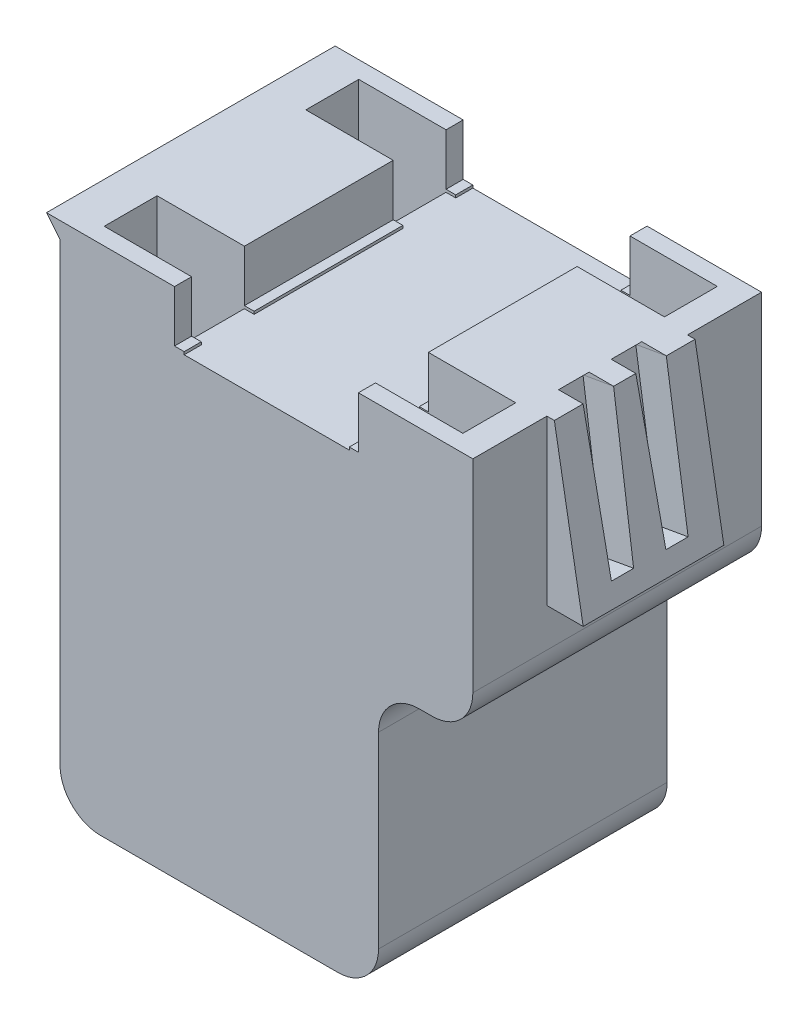
from build123d import *

# Parameters (mm, degrees)
SALIENTE_EXTRUIR1_DEPTH = 21.3
SALIENTE_EXTRUIR2_DEPTH = 21.3
CORTAR_EXTRUIR1_DEPTH   = 5.46
CORTAR_EXTRUIR3_DEPTH   = 5.46
CORTAR_EXTRUIR4_DEPTH   = 2.29
CORTAR_EXTRUIR5_DEPTH   = 4
CROQUIS7_W              = 6.437906951
CROQUIS7_H              = 3.9
CROQUIS7_W_2            = 6.445
CORTAR_EXTRUIR6_DEPTH   = 12
SALIENTE_EXTRUIR3_DEPTH = 21.3
CORTAR_EXTRUIR8_DEPTH   = 0.01
CORTAR_EXTRUIR10_DEPTH  = 0.01


with BuildPart() as part:
    # Croquis1 → Saliente-Extruir1 (new body)
    with BuildSketch(Plane.XY):
        with BuildLine():
            Line((-15.23, 18.9), (-6.785, 18.9))
            Line((-6.785, 18.9), (-6.785, 15.1))
            Line((-6.785, 15.1), (6.785, 15.1))
            Line((6.785, 15.1), (6.785, 18.9))
            Line((6.785, 18.9), (15.23, 18.9))
            Line((15.23, 18.9), (15.23, 3.95))
            ThreePointArc((15.23, 3.95), (14.351320344, 1.828679656), (12.23, 0.95))
            Line((12.23, 0.95), (11.27, 0.95))
            ThreePointArc((11.27, 0.95), (9.148679656, 0.071320344), (8.27, -2.05))
            Line((8.27, -2.05), (8.27, -15.9))
            ThreePointArc((8.27, -15.9), (7.391320344, -18.021320344), (5.27, -18.9))
            Line((5.27, -18.9), (-12.23, -18.9))
            ThreePointArc((-12.23, -18.9), (-14.351320344, -18.021320344), (-15.23, -15.9))
            Line((-15.23, -15.9), (-15.23, 18.9))
        make_face()
    extrude(amount=SALIENTE_EXTRUIR1_DEPTH)

    # Croquis2 → Saliente-Extruir2 (add, through all)
    with BuildSketch(Plane(origin=(0, 0, 0), x_dir=(-1, 0, 0), z_dir=(0, 0, -1))):
        Polygon((-15.23, 18.9), (-15.784402422, 18.9), (-17.91, 6.8), (-15.23, 6.8), align=None)
    extrude(amount=-SALIENTE_EXTRUIR2_DEPTH)

    # Croquis3 → Cortar-Extruir1 (cut)
    with BuildSketch(Plane(origin=(0, 0, 0), x_dir=(-1, 0, 0), z_dir=(0, 0, -1))):
        Polygon((-15.23, 6.8), (-15.23, 18.9), (-15.784402422, 18.9), (-17.91, 6.8), align=None)
    extrude(amount=-CORTAR_EXTRUIR1_DEPTH, mode=Mode.SUBTRACT)

    # Croquis4 → Cortar-Extruir3 (cut)
    with BuildSketch(Plane.XY.offset(21.3)):
        Polygon((17.91, 6.8), (15.23, 6.8), (15.23, 18.9), (15.784402422, 18.9), align=None)
    extrude(amount=-CORTAR_EXTRUIR3_DEPTH, mode=Mode.SUBTRACT)

    # Croquis5 → Cortar-Extruir4 (cut)
    with BuildSketch(Plane(origin=(18.532639468, 3.255614345, 0), x_dir=(0, 0, -1), z_dir=(0.9849183396205656, 0.17301983781944785, 0))):
        Polygon((-13.72, 15.883941872), (-13.72, 16.197349498), (-11.47, 16.197349498), (-11.47, 15.883941872), (-11.84, 5.198659414), (-13.48, 5.198659414), align=None)
        Polygon((-9.83, 15.883941872), (-9.83, 16.197349498), (-7.58, 16.197349498), (-7.58, 15.883941872), (-7.82, 5.198659414), (-9.46, 5.198659414), align=None)
    extrude(amount=-CORTAR_EXTRUIR4_DEPTH, mode=Mode.SUBTRACT)

    # Croquis6 → Cortar-Extruir5 (cut)
    with BuildSketch(Plane(origin=(0, 18.9, 0), x_dir=(1, 0, 0), z_dir=(0, 1, 0))):
        Polygon((13.23, -20.037842324), (13.23, -16.137842324), (6.115382799, -16.137842324), (6.115382799, -5.162157676), (13.23, -5.162157676), (13.23, -1.262157676), (6.115382799, -1.262157676), (6.115382799, 0), (-6.070170326, 0), (-6.070170326, -1.262157676), (-13.23, -1.262157676), (-13.23, -5.162157676), (-6.070170326, -5.162157676), (-6.070170326, -16.137842324), (-13.23, -16.137842324), (-13.23, -20.037842324), (-6.070170326, -20.037842324), (-6.070170326, -21.708109795), (6.115382799, -21.708109795), (6.115382799, -20.037842324), align=None)
    extrude(amount=-CORTAR_EXTRUIR5_DEPTH, mode=Mode.SUBTRACT)

    # Croquis7 → Cortar-Extruir6 (cut)
    with BuildSketch(Plane(origin=(0, 14.9, 0), x_dir=(1, 0, 0), z_dir=(0, 1, 0))):
        with Locations((-10.011046524, -3.212157676)):
            Rectangle(CROQUIS7_W, CROQUIS7_H)
        with Locations((10.0075, -3.212157676)):
            Rectangle(CROQUIS7_W_2, CROQUIS7_H)
        with Locations((10.0075, -18.087842324)):
            Rectangle(CROQUIS7_W_2, CROQUIS7_H)
        with Locations((-10.011046524, -18.087842324)):
            Rectangle(CROQUIS7_W, CROQUIS7_H)
    extrude(amount=-CORTAR_EXTRUIR6_DEPTH, mode=Mode.SUBTRACT)

    # Croquis10 → Saliente-Extruir3 (add, through all)
    with BuildSketch(Plane.XY.offset(21.3)):
        Polygon((-15.23, 18.9), (-16.23, 18.9), (-15.23, 17.671944282), align=None)
    extrude(amount=-SALIENTE_EXTRUIR3_DEPTH)

    # Croquis11 → Cortar-Extruir8 (cut)
    # profile 1 of 6: a face of its own
    with BuildSketch(Plane(origin=(0, 0, 0), x_dir=(-1, 0, 0), z_dir=(0, 0, -1))):
        with BuildLine():
            Line((0.047489316, -3.533287629), (0.204055656, -3.439422028))
            add(Edge.make_bspline(
                [(0.204055656, -3.439422028), (0.21861739, -3.463797765), (0.24651711, -3.510500736), (0.293058037, -3.573608116), (0.341282536, -3.627245591), (0.391547725, -3.671101129), (0.443546789, -3.705628665), (0.497619184, -3.730077346), (0.553582693, -3.745325799), (0.59166884, -3.747177928), (0.610682926, -3.748102583)],
                knots=[0, 0, 0, 0, 1.272034388, 2.437168799, 3.508375237, 4.49857839, 5.41946034, 6.295179144, 7.148887113, 8, 8, 8, 8], degree=3))
            add(Edge.make_bspline(
                [(0.610682926, -3.748102583), (0.62692139, -3.747650319), (0.659114182, -3.746753704), (0.706507536, -3.738138446), (0.752535406, -3.724902862), (0.796249144, -3.705947619), (0.837045573, -3.683014337), (0.872820782, -3.655314484), (0.903748517, -3.624302034), (0.929047507, -3.589703712), (0.948457359, -3.552494221), (0.963375662, -3.514301114), (0.971654514, -3.474524413), (0.972901629, -3.447743043), (0.973530983, -3.434227884)],
                knots=[0, 0, 0, 0, 1.095163259, 2.171163733, 3.241058638, 4.321873601, 5.38011039, 6.391990106, 7.366004449, 8.327778327, 9.272591725, 10.192022065, 11.087607919, 12, 12, 12, 12], degree=3))
            add(Edge.make_bspline(
                [(0.973530983, -3.434227884), (0.972750827, -3.418807517), (0.971164884, -3.387460166), (0.957760309, -3.341211183), (0.936673416, -3.295442198), (0.91721985, -3.267131112), (0.907120142, -3.252432845)],
                knots=[0, 0, 0, 0, 0.938893495, 1.908633276, 2.914225137, 4, 4, 4, 4], degree=3))
            add(Edge.make_bspline(
                [(0.907120142, -3.252432845), (0.898827776, -3.241824734), (0.881418989, -3.219554332), (0.851490639, -3.186404562), (0.816371903, -3.152210649), (0.777264605, -3.115666898), (0.732744179, -3.078472939), (0.684205036, -3.038855141), (0.630407911, -2.99832014), (0.592678594, -2.971135491), (0.573210887, -2.95710866)],
                knots=[0, 0, 0, 0, 0.722233717, 1.516239348, 2.393582979, 3.351407094, 4.387010283, 5.505090956, 6.712668013, 8, 8, 8, 8], degree=3))
            add(Edge.make_bspline(
                [(0.573210887, -2.95710866), (0.553724856, -2.943229365), (0.516469048, -2.916693212), (0.464368048, -2.877310361), (0.417777853, -2.841303814), (0.37690554, -2.808334607), (0.341769087, -2.778398271), (0.312091615, -2.751782278), (0.288629129, -2.72776681), (0.275582217, -2.712187433), (0.269724476, -2.705192677)],
                knots=[0, 0, 0, 0, 1.452282411, 2.77665338, 3.964542531, 5.026858415, 5.96415736, 6.766646006, 7.446254459, 8, 8, 8, 8], degree=3))
            add(Edge.make_bspline(
                [(0.269724476, -2.705192677), (0.261536921, -2.694291295), (0.245434995, -2.672852265), (0.224180483, -2.639342861), (0.206115176, -2.605040549), (0.191953442, -2.569853154), (0.180028026, -2.534274671), (0.172006955, -2.497840887), (0.166984424, -2.460715285), (0.166470081, -2.435731474), (0.166212607, -2.423224862)],
                knots=[0, 0, 0, 0, 1.068054152, 2.10047183, 3.106115577, 4.101338837, 5.06977816, 6.043150881, 7.020423561, 8, 8, 8, 8], degree=3))
            add(Edge.make_bspline(
                [(0.166212607, -2.423224862), (0.16690328, -2.40362994), (0.168269863, -2.364858923), (0.179827137, -2.308221775), (0.198069043, -2.254148129), (0.223625088, -2.203173328), (0.256569604, -2.156624663), (0.294693932, -2.113966693), (0.34010251, -2.078105818), (0.38992494, -2.04677277), (0.444458937, -2.022248051), (0.501604123, -2.003747866), (0.561451324, -1.993265467), (0.601987149, -1.991761171), (0.622555255, -1.990997882)],
                knots=[0, 0, 0, 0, 1.005424448, 1.989358655, 2.955360095, 3.929531133, 4.905563448, 5.876582895, 6.856512386, 7.866279853, 8.892233794, 9.918561126, 10.94386622, 12, 12, 12, 12], degree=3))
            add(Edge.make_bspline(
                [(0.622555255, -1.990997882), (0.644380258, -1.991750649), (0.687783223, -1.993247662), (0.751626767, -2.006263856), (0.813095146, -2.027801295), (0.862542207, -2.052242793), (0.901241626, -2.076654), (0.930754697, -2.098889491), (0.960661848, -2.124487986), (0.991204319, -2.15351767), (1.021864585, -2.186244909), (1.053097828, -2.222445565), (1.084977087, -2.26189841), (1.105485396, -2.290063041), (1.115998932, -2.304501572)],
                knots=[0, 0, 0, 0, 1.286793592, 2.559021753, 3.825965368, 5.121522368, 5.803751409, 6.523245864, 7.299691795, 8.125521123, 9.008227632, 9.944561021, 10.946284179, 12, 12, 12, 12], degree=3))
            Line((1.115998932, -2.304501572), (0.965739767, -2.418401729))
            add(Edge.make_bspline(
                [(0.965739767, -2.418401729), (0.956666711, -2.40671313), (0.939194127, -2.384203622), (0.912667273, -2.352680467), (0.887664864, -2.32388508), (0.863031944, -2.29887395), (0.84006948, -2.276277404), (0.817782546, -2.2569312), (0.796491868, -2.24064578), (0.76965417, -2.223266063), (0.735936877, -2.206038247), (0.693611726, -2.191460193), (0.649380656, -2.182699806), (0.619255393, -2.18154152), (0.604004741, -2.180955147)],
                knots=[0, 0, 0, 0, 1.181633172, 2.275549214, 3.290209073, 4.226197932, 5.078386478, 5.862611352, 6.581680152, 7.217281963, 8.414376989, 9.595101626, 10.782541182, 12, 12, 12, 12], degree=3))
            add(Edge.make_bspline(
                [(0.604004741, -2.180955147), (0.584871914, -2.181596339), (0.547976061, -2.182832815), (0.495593728, -2.196337141), (0.448448192, -2.217600042), (0.407939127, -2.247400051), (0.374211643, -2.282706577), (0.349814171, -2.323335387), (0.335129709, -2.368199409), (0.333337803, -2.399495202), (0.332425214, -2.415433646)],
                knots=[0, 0, 0, 0, 1.14458467, 2.207223713, 3.21896685, 4.227309161, 5.202851033, 6.127160689, 7.046193047, 8, 8, 8, 8], degree=3))
            add(Edge.make_bspline(
                [(0.332425214, -2.415433646), (0.332633243, -2.425356304), (0.333049642, -2.445217844), (0.338857139, -2.474560888), (0.346318034, -2.503829805), (0.35814101, -2.532893005), (0.374463317, -2.56225877), (0.395897306, -2.592432773), (0.42289185, -2.623680969), (0.443570102, -2.644004871), (0.454487597, -2.654735279)],
                knots=[0, 0, 0, 0, 0.858281714, 1.717966888, 2.583508476, 3.4729293, 4.427298488, 5.488583878, 6.674047936, 8, 8, 8, 8], degree=3))
            add(Edge.make_bspline(
                [(0.454487597, -2.654735279), (0.45854174, -2.658353205), (0.468173455, -2.666948569), (0.485781966, -2.681020318), (0.50903503, -2.698378452), (0.537325445, -2.719855907), (0.57117484, -2.744769847), (0.610586939, -2.772801717), (0.655122417, -2.804861522), (0.686725264, -2.827275721), (0.703435497, -2.83912739)],
                knots=[0, 0, 0, 0, 0.420754252, 0.999615792, 1.744751191, 2.668019286, 3.750313428, 4.999500688, 6.413464383, 8, 8, 8, 8], degree=3))
            add(Edge.make_bspline(
                [(0.703435497, -2.83912739), (0.723536376, -2.853754276), (0.762458942, -2.882077213), (0.817840245, -2.924630511), (0.868054885, -2.966248288), (0.913279164, -3.006664772), (0.953959861, -3.045573388), (0.989645655, -3.083442237), (1.020700161, -3.12000002), (1.054132497, -3.166869674), (1.088294343, -3.224432998), (1.117632141, -3.294959399), (1.136130933, -3.365759952), (1.138550027, -3.413346237), (1.13974359, -3.436824956)],
                knots=[0, 0, 0, 0, 1.163667725, 2.253281268, 3.268753668, 4.215851969, 5.092017293, 5.902905408, 6.650798638, 7.335211899, 8.59617414, 9.77448103, 10.901945474, 12, 12, 12, 12], degree=3))
            add(Edge.make_bspline(
                [(1.13974359, -3.436824956), (1.139395854, -3.453429341), (1.138707136, -3.486315664), (1.130790319, -3.534604809), (1.119191163, -3.581505311), (1.10170896, -3.626437441), (1.080371289, -3.670223212), (1.053295816, -3.711714059), (1.021912166, -3.751828278), (0.985910965, -3.789496209), (0.946516675, -3.824075238), (0.904879887, -3.854835199), (0.860932451, -3.880483021), (0.814912775, -3.901412008), (0.766810288, -3.917780994), (0.716641169, -3.929641137), (0.66432272, -3.936920201), (0.628762465, -3.937675725), (0.610682926, -3.938059848)],
                knots=[0, 0, 0, 0, 0.983748083, 1.948392443, 2.894712957, 3.844097841, 4.80183111, 5.778335162, 6.776009319, 7.81870978, 8.863265674, 9.881300176, 10.883814829, 11.87499822, 12.874611388, 13.892143829, 14.928324115, 16, 16, 16, 16], degree=3))
            add(Edge.make_bspline(
                [(0.610682926, -3.938059848), (0.596694224, -3.937789348), (0.568892992, -3.937251754), (0.527771725, -3.93249916), (0.487481192, -3.925774984), (0.448526968, -3.915099539), (0.410407171, -3.902147138), (0.373287593, -3.886198937), (0.337150243, -3.867086918), (0.301792606, -3.845234968), (0.267304605, -3.819804411), (0.23400972, -3.790185103), (0.200815526, -3.75719394), (0.168701779, -3.719935017), (0.137018907, -3.679010281), (0.106391581, -3.634036838), (0.076185839, -3.585259655), (0.057233487, -3.550935214), (0.047489316, -3.533287629)],
                knots=[0, 0, 0, 0, 0.915332311, 1.819136955, 2.706846663, 3.586547465, 4.459518054, 5.340707479, 6.227863349, 7.133153174, 8.059268498, 9.028702269, 10.047606654, 11.120612155, 12.245963614, 13.433783089, 14.680604001, 16, 16, 16, 16], degree=3))
        make_face()
    # profile 2 of 6: a face of its own
    with BuildSketch(Plane(origin=(0, 0, 0), x_dir=(-1, 0, 0), z_dir=(0, 0, -1))):
        with BuildLine():
            Line((3.229273504, -2.378332618), (3.083837473, -2.489635703))
            add(Edge.make_bspline(
                [(3.083837473, -2.489635703), (3.073462691, -2.47727121), (3.052853, -2.452708926), (3.019695839, -2.418218084), (2.985140386, -2.385904383), (2.949199851, -2.355613888), (2.911227317, -2.32840585), (2.872142644, -2.302862391), (2.831292012, -2.279966546), (2.774802553, -2.252204883), (2.700905566, -2.223235042), (2.607880797, -2.198944583), (2.510772841, -2.18348171), (2.444522444, -2.181806982), (2.41082482, -2.180955147)],
                knots=[0, 0, 0, 0, 0.757959112, 1.505699292, 2.245454638, 2.979532153, 3.711538275, 4.438200793, 5.171680507, 5.909471876, 7.393775596, 8.890124382, 10.418191784, 12, 12, 12, 12], degree=3))
            add(Edge.make_bspline(
                [(2.41082482, -2.180955147), (2.392259907, -2.181168911), (2.355302382, -2.181594454), (2.300455065, -2.187208449), (2.246631908, -2.195098965), (2.193867924, -2.206806948), (2.142230275, -2.221609126), (2.091381379, -2.239296741), (2.042057437, -2.261180343), (1.993576119, -2.285367631), (1.947126287, -2.312687154), (1.903176324, -2.342486302), (1.861886524, -2.374431616), (1.823224225, -2.408642826), (1.787149903, -2.444965864), (1.753924951, -2.483787828), (1.723664338, -2.524984603), (1.695768245, -2.568012948), (1.670784841, -2.612747529), (1.649866946, -2.659353921), (1.631343402, -2.707034009), (1.616685886, -2.756326498), (1.605084163, -2.806884545), (1.597079108, -2.858843837), (1.591528958, -2.912095826), (1.591105531, -2.94818992), (1.590892094, -2.966383917)],
                knots=[0, 0, 0, 0, 1.054917814, 2.100044995, 3.131103042, 4.146048494, 5.169673617, 6.183595914, 7.203665975, 8.234915748, 9.262203917, 10.264457458, 11.251630812, 12.227803204, 13.197192746, 14.159520551, 15.12972552, 16.100847026, 17.073214652, 18.039054194, 19.002613845, 19.979014051, 20.95965708, 21.949030935, 22.966165397, 24, 24, 24, 24], degree=3))
            add(Edge.make_bspline(
                [(1.590892094, -2.966383917), (1.591559807, -2.993758407), (1.592870772, -3.047504587), (1.604538015, -3.126229035), (1.622267793, -3.201646225), (1.648840202, -3.273284725), (1.6816057, -3.342027898), (1.723008023, -3.406712624), (1.770959274, -3.46831639), (1.826137821, -3.525383283), (1.886677565, -3.577513463), (1.951631669, -3.623418979), (2.020838354, -3.661685604), (2.093533488, -3.693528709), (2.170276473, -3.718006227), (2.250929306, -3.735238076), (2.33531657, -3.74647873), (2.392979544, -3.74755489), (2.422326138, -3.748102583)],
                knots=[0, 0, 0, 0, 1.029171465, 2.020641659, 2.987623507, 3.938342917, 4.889210282, 5.84687017, 6.821220943, 7.821438502, 8.827599549, 9.822697543, 10.807740252, 11.797342354, 12.80366471, 13.83203677, 14.896651826, 16, 16, 16, 16], degree=3))
            add(Edge.make_bspline(
                [(2.422326138, -3.748102583), (2.454659645, -3.747208937), (2.51829972, -3.745450028), (2.6116278, -3.730549092), (2.70097006, -3.706388444), (2.786331304, -3.672575793), (2.867470887, -3.628620412), (2.944515787, -3.575334452), (3.017531034, -3.512211042), (3.061436671, -3.464012887), (3.083837473, -3.439422028)],
                knots=[0, 0, 0, 0, 1.028121516, 2.023589091, 2.998037872, 3.967518031, 4.937445131, 5.927275754, 6.942489185, 8, 8, 8, 8], degree=3))
            Line((3.083837473, -3.439422028), (3.229273504, -3.549612082))
            add(Edge.make_bspline(
                [(3.229273504, -3.549612082), (3.217569338, -3.564713679), (3.194217067, -3.594844538), (3.156403866, -3.637321651), (3.11656963, -3.67727587), (3.074418483, -3.71438507), (3.030435319, -3.749391808), (2.983830387, -3.781301527), (2.935216357, -3.81055962), (2.884757945, -3.837349701), (2.832508763, -3.861118411), (2.778531416, -3.881466863), (2.72305857, -3.89899545), (2.666087688, -3.913416267), (2.6075006, -3.924672215), (2.547508724, -3.932196793), (2.485982582, -3.937351889), (2.444473997, -3.937821745), (2.423439169, -3.938059848)],
                knots=[0, 0, 0, 0, 0.986787822, 1.968848986, 2.935600012, 3.899624008, 4.868462664, 5.837806735, 6.815139263, 7.798259679, 8.787526145, 9.778297419, 10.776456485, 11.791383307, 12.812564526, 13.85620153, 14.913611965, 16, 16, 16, 16], degree=3))
            add(Edge.make_bspline(
                [(2.423439169, -3.938059848), (2.403519396, -3.93792121), (2.36413051, -3.937647071), (2.305975753, -3.933206216), (2.249360434, -3.927147397), (2.194446361, -3.918024494), (2.140933866, -3.907258948), (2.089308056, -3.892827908), (2.039060924, -3.876662307), (1.990394344, -3.857662585), (1.943266919, -3.836222772), (1.897830653, -3.811991405), (1.85410644, -3.785172252), (1.811664405, -3.756356475), (1.771131517, -3.724618487), (1.732156527, -3.690399059), (1.694520883, -3.653813528), (1.671236129, -3.627432002), (1.659528996, -3.614167871)],
                knots=[0, 0, 0, 0, 1.114604814, 2.203992996, 3.262667896, 4.300477797, 5.318619304, 6.316056647, 7.298880507, 8.271930387, 9.238335007, 10.195173496, 11.151986948, 12.108099108, 13.064862484, 14.031167946, 15.010108607, 16, 16, 16, 16], degree=3))
            add(Edge.make_bspline(
                [(1.659528996, -3.614167871), (1.640777635, -3.591127325), (1.603501295, -3.545324399), (1.555809788, -3.471089734), (1.514985873, -3.39358364), (1.481978615, -3.312398928), (1.456175002, -3.227717769), (1.43829912, -3.139497476), (1.426683062, -3.04782044), (1.425354701, -2.985465139), (1.424679487, -2.953769567)],
                knots=[0, 0, 0, 0, 0.994628077, 1.977248131, 2.950237994, 3.925870899, 4.908910175, 5.911660606, 6.938484602, 8, 8, 8, 8], degree=3))
            add(Edge.make_bspline(
                [(1.424679487, -2.953769567), (1.425502444, -2.92045564), (1.427121559, -2.854912567), (1.440877668, -2.75872385), (1.463006781, -2.666568735), (1.494437634, -2.578619253), (1.534286716, -2.494412813), (1.583513299, -2.414592676), (1.641545495, -2.338648369), (1.707928167, -2.26773223), (1.780724215, -2.202888489), (1.858680421, -2.14584104), (1.941644201, -2.098365521), (2.028701564, -2.058680052), (2.120504404, -2.028176523), (2.216856853, -2.006822962), (2.317577862, -1.993531821), (2.386296729, -1.991851607), (2.421213108, -1.990997882)],
                knots=[0, 0, 0, 0, 1.032925535, 2.032216505, 3.007276963, 3.968222605, 4.92396291, 5.891752235, 6.871517503, 7.883894988, 8.900124299, 9.891468569, 10.874487609, 11.85992873, 12.854644235, 13.869047385, 14.917252991, 16, 16, 16, 16], degree=3))
            add(Edge.make_bspline(
                [(2.421213108, -1.990997882), (2.442493266, -1.991253014), (2.484615196, -1.991758021), (2.546925974, -1.996682521), (2.607590872, -2.004891804), (2.666651683, -2.016065725), (2.724395735, -2.029933766), (2.780381695, -2.047999673), (2.834938084, -2.068656505), (2.887720823, -2.092447026), (2.938476664, -2.119152343), (2.987189799, -2.148476444), (3.033473287, -2.180382975), (3.077652802, -2.214600572), (3.118989297, -2.251853143), (3.158656413, -2.291116037), (3.195307067, -2.333520186), (3.217930633, -2.363367797), (3.229273504, -2.378332618)],
                knots=[0, 0, 0, 0, 1.096760587, 2.17092713, 3.219439832, 4.250915756, 5.268269357, 6.278326846, 7.281116186, 8.274029601, 9.260640565, 10.235837813, 11.203064059, 12.156899882, 13.114053108, 14.069676657, 15.032185724, 16, 16, 16, 16], degree=3))
        make_face()
    # profile 3 of 6: a face of its own
    with BuildSketch(Plane(origin=(0, 0, 0), x_dir=(-1, 0, 0), z_dir=(0, 0, -1))):
        Polygon((3.395486111, -2.228444464), (3.395486111, -2.038487199), (4.369017094, -2.038487199), (4.369017094, -2.228444464), (3.965357906, -2.228444464), (3.965357906, -3.890570532), (3.799145299, -3.890570532), (3.799145299, -2.228444464), align=None)
    # profile 4 of 6: a face of its own
    with BuildSketch(Plane(origin=(0, 0, 0), x_dir=(-1, 0, 0), z_dir=(0, 0, -1))):
        with BuildLine():
            add(Edge.make_bspline(
                [(4.487740385, -2.965270886), (4.487913961, -2.935586018), (4.488251135, -2.877922735), (4.492002091, -2.793899195), (4.49823321, -2.715074375), (4.50677257, -2.641444503), (4.517164334, -2.572990569), (4.531036696, -2.50989551), (4.546812637, -2.451867302), (4.56509664, -2.398716718), (4.585727678, -2.349727683), (4.608182475, -2.303994348), (4.633352178, -2.261585908), (4.659798295, -2.221825494), (4.688591349, -2.185363956), (4.718911959, -2.15168638), (4.751943535, -2.121571108), (4.786563211, -2.094135773), (4.823084423, -2.070085428), (4.860466167, -2.048901437), (4.898965744, -2.030804007), (4.938688266, -2.016574485), (4.979276703, -2.004821245), (5.020872942, -1.99678376), (5.063545664, -1.991726563), (5.092348965, -1.99124308), (5.106956547, -1.990997882)],
                knots=[0, 0, 0, 0, 1.646270934, 3.197905019, 4.663502075, 6.030701355, 7.308322542, 8.50163776, 9.611534131, 10.641858119, 11.616356847, 12.558055219, 13.465016945, 14.349605745, 15.204443733, 16.039544428, 16.859896111, 17.680448484, 18.487036065, 19.28249412, 20.06191084, 20.843045899, 21.620316918, 22.403196591, 23.190181807, 24, 24, 24, 24], degree=3))
            add(Edge.make_bspline(
                [(5.106956547, -1.990997882), (5.121686155, -1.991256018), (5.150978709, -1.991769368), (5.194285908, -1.996703288), (5.236592614, -2.00489009), (5.277718463, -2.01648994), (5.318001268, -2.030880985), (5.35712595, -2.048918751), (5.395335531, -2.069915485), (5.432022808, -2.094587287), (5.467590542, -2.122094575), (5.501165089, -2.15318982), (5.532749506, -2.187559047), (5.562740188, -2.224834533), (5.590286275, -2.265731224), (5.616518883, -2.309537815), (5.639999085, -2.357020398), (5.662612851, -2.407386729), (5.682132215, -2.462030415), (5.699735603, -2.520643434), (5.713959057, -2.583918108), (5.725806714, -2.651522454), (5.734985054, -2.723704748), (5.741669827, -2.800310256), (5.745201002, -2.88138938), (5.745866006, -2.936823741), (5.746207265, -2.965270886)],
                knots=[0, 0, 0, 0, 0.810914788, 1.612654377, 2.396697861, 3.181598691, 3.963628158, 4.749916497, 5.551656086, 6.361998678, 7.18212741, 8.025565596, 8.878627764, 9.750805457, 10.657531673, 11.591944965, 12.560506719, 13.57287815, 14.630710178, 15.753379473, 16.941251878, 18.199788006, 19.531962791, 20.947069417, 22.433333509, 24, 24, 24, 24], degree=3))
            add(Edge.make_bspline(
                [(5.746207265, -2.965270886), (5.745862468, -2.993593954), (5.745190646, -3.048780297), (5.741709413, -3.129494604), (5.734852138, -3.205693569), (5.726274352, -3.277559939), (5.714394051, -3.344794595), (5.699786317, -3.407630199), (5.683567188, -3.466338104), (5.663546276, -3.520437358), (5.641633108, -3.570682645), (5.6177914, -3.617602344), (5.592248618, -3.661611174), (5.564420407, -3.702356874), (5.534758809, -3.74012808), (5.502628979, -3.774258072), (5.468936628, -3.805569219), (5.433264224, -3.833430705), (5.396004778, -3.857817248), (5.357926434, -3.879626243), (5.31835356, -3.897211878), (5.278182956, -3.91231167), (5.236840029, -3.923847743), (5.194376314, -3.931824325), (5.151007805, -3.937418595), (5.121691144, -3.937845357), (5.106956547, -3.938059848)],
                knots=[0, 0, 0, 0, 1.561518951, 3.042555995, 4.452378317, 5.7783523, 7.031515105, 8.214008947, 9.334062868, 10.386615937, 11.391082383, 12.354592575, 13.286541444, 14.194233754, 15.072674879, 15.931287219, 16.775624067, 17.606195743, 18.42308326, 19.229000347, 20.022332153, 20.807536673, 21.593273796, 22.3848459, 23.188221202, 24, 24, 24, 24], degree=3))
            add(Edge.make_bspline(
                [(5.106956547, -3.938059848), (5.09234937, -3.937813068), (5.063546868, -3.937326467), (5.020868293, -3.932292117), (4.979443834, -3.924198247), (4.939069076, -3.912865294), (4.899536879, -3.898993276), (4.861385927, -3.880920285), (4.824192028, -3.860106007), (4.788054413, -3.836401763), (4.753652144, -3.809244039), (4.720791632, -3.77920627), (4.690298393, -3.745538881), (4.661917017, -3.708773481), (4.634943229, -3.669248306), (4.610130935, -3.626423709), (4.587180525, -3.580469494), (4.566202511, -3.531088767), (4.54760301, -3.477560951), (4.531173598, -3.419273677), (4.518201523, -3.355712486), (4.507098043, -3.287387879), (4.498142223, -3.214006258), (4.492028059, -3.135527784), (4.488249113, -3.052001361), (4.487913055, -2.994708605), (4.487740385, -2.965270886)],
                knots=[0, 0, 0, 0, 0.810891512, 1.598919785, 2.382837074, 3.152667961, 3.926044502, 4.706494248, 5.493654104, 6.291793342, 7.103789334, 7.925228297, 8.761435821, 9.622817696, 10.50288917, 11.416980706, 12.369136599, 13.353924996, 14.394355917, 15.514179734, 16.714354668, 17.994756427, 19.357759367, 20.818452758, 22.365282078, 24, 24, 24, 24], degree=3))
        make_face()
        with BuildLine():
            add(Edge.make_bspline(
                [(4.653952991, -2.964528865), (4.654016199, -2.989266718), (4.654138872, -3.037278034), (4.657343611, -3.107045093), (4.661709359, -3.172116892), (4.667340379, -3.232576055), (4.675702773, -3.288217936), (4.685072615, -3.339425227), (4.696475145, -3.385926932), (4.709966259, -3.428042148), (4.725332781, -3.466485614), (4.742110467, -3.502257923), (4.760134266, -3.535781656), (4.78030565, -3.566755691), (4.802274038, -3.595281036), (4.825543221, -3.621862576), (4.85098163, -3.645567646), (4.886173194, -3.673998106), (4.932632161, -3.703376981), (4.991168819, -3.72896012), (5.051318374, -3.745037504), (5.092144244, -3.747082075), (5.112521701, -3.748102583)],
                knots=[0, 0, 0, 0, 1.459021318, 2.831673884, 4.118529203, 5.306027144, 6.411944654, 7.436330062, 8.375795394, 9.233974572, 10.042671642, 10.816086306, 11.563610507, 12.285937304, 12.993564865, 13.685989202, 14.367179055, 15.041617293, 16.353048772, 17.594441528, 18.799311195, 20, 20, 20, 20], degree=3))
            add(Edge.make_bspline(
                [(5.112521701, -3.748102583), (5.133030969, -3.747257091), (5.174007161, -3.745567852), (5.233873794, -3.729270187), (5.291992312, -3.704680055), (5.337538714, -3.675603667), (5.372189893, -3.647913259), (5.397016801, -3.624304675), (5.419803801, -3.597869695), (5.441416066, -3.569347984), (5.46123816, -3.538194628), (5.479263237, -3.504559432), (5.495711508, -3.468348992), (5.505082545, -3.443070838), (5.509873715, -3.430146771)],
                knots=[0, 0, 0, 0, 1.353760809, 2.704726607, 4.075137775, 5.516104923, 6.260822281, 7.007110065, 7.778089737, 8.566572457, 9.372053459, 10.217411131, 11.088608312, 12, 12, 12, 12], degree=3))
            add(Edge.make_bspline(
                [(5.509873715, -3.430146771), (5.515457358, -3.413621033), (5.52679455, -3.3800667), (5.54140578, -3.328015934), (5.552912721, -3.273404471), (5.563265002, -3.21655868), (5.570330994, -3.157059339), (5.576018379, -3.095090544), (5.579368367, -3.030605573), (5.579783631, -2.986793223), (5.579994658, -2.964528865)],
                knots=[0, 0, 0, 0, 0.884706709, 1.796334032, 2.740027952, 3.714592787, 4.726048262, 5.777819803, 6.87074269, 8, 8, 8, 8], degree=3))
            add(Edge.make_bspline(
                [(5.579994658, -2.964528865), (5.579703516, -2.942268108), (5.579133981, -2.898721308), (5.576956996, -2.834947105), (5.571335354, -2.774374581), (5.565091654, -2.716742789), (5.555885624, -2.662370754), (5.545959618, -2.610803301), (5.532623977, -2.562679284), (5.518378929, -2.517245255), (5.502075095, -2.475017409), (5.484128019, -2.435798863), (5.464960671, -2.39940028), (5.444142069, -2.365921523), (5.421919353, -2.335212636), (5.397705984, -2.30788933), (5.37246242, -2.283104767), (5.337104992, -2.254814158), (5.290816514, -2.225968386), (5.233219025, -2.199422338), (5.173279976, -2.18417795), (5.132759857, -2.18202864), (5.112521701, -2.180955147)],
                knots=[0, 0, 0, 0, 1.31362396, 2.569729283, 3.763502607, 4.902122613, 5.988968491, 7.01645872, 7.998833611, 8.933434873, 9.825090667, 10.667526885, 11.477055099, 12.250526234, 12.991942729, 13.710640831, 14.402115721, 15.076753259, 16.378508321, 17.609869233, 18.806226677, 20, 20, 20, 20], degree=3))
            add(Edge.make_bspline(
                [(5.112521701, -2.180955147), (5.092037346, -2.182030121), (5.051031319, -2.184182027), (4.990469276, -2.199365541), (4.93241739, -2.225830735), (4.886251316, -2.254909699), (4.850869229, -2.282605389), (4.825954637, -2.306622387), (4.802593954, -2.33289353), (4.781073963, -2.36168121), (4.760918384, -2.392619134), (4.742407598, -2.425950688), (4.725729678, -2.461844785), (4.710339111, -2.500270982), (4.696806844, -2.542382565), (4.685644622, -2.588826991), (4.675332723, -2.639871409), (4.668032726, -2.695814649), (4.661543155, -2.756288955), (4.657372609, -2.821523202), (4.654128152, -2.89140727), (4.654012548, -2.939666825), (4.653952991, -2.964528865)],
                knots=[0, 0, 0, 0, 1.207732386, 2.417664972, 3.655092373, 4.956220595, 5.625982001, 6.301752483, 6.994047911, 7.697131622, 8.419323945, 9.170223765, 9.943494443, 10.752040957, 11.610060368, 12.549350801, 13.567764191, 14.679664412, 15.874934091, 17.154273443, 18.533957287, 20, 20, 20, 20], degree=3))
        make_face(mode=Mode.SUBTRACT)
    # profile 5 of 6: a face of its own
    with BuildSketch(Plane(origin=(0, 0, 0), x_dir=(-1, 0, 0), z_dir=(0, 0, -1))):
        Polygon((6.306061782, -2.038487199), (6.648504274, -2.038487199), (6.648504274, -3.890570532), (6.482291667, -3.890570532), (6.482291667, -2.228444464), (6.197355769, -2.228444464), align=None)
    # profile 6 of 6: a face of its own
    with BuildSketch(Plane(origin=(0, 0, 0), x_dir=(-1, 0, 0), z_dir=(0, 0, -1))):
        with BuildLine():
            Line((7.57454594, -2.465891045), (7.408333333, -2.465891045))
            add(Edge.make_bspline(
                [(7.408333333, -2.465891045), (7.412836304, -2.447247189), (7.421639243, -2.410799975), (7.440000042, -2.358726133), (7.460002148, -2.309448269), (7.484020549, -2.263889097), (7.510218932, -2.221133011), (7.540234705, -2.182149766), (7.572683058, -2.145947905), (7.608573761, -2.113820483), (7.646212678, -2.084728102), (7.686130164, -2.059923384), (7.727523112, -2.038585186), (7.770678311, -2.021006147), (7.815724244, -2.007763474), (7.86225367, -1.998155498), (7.910388522, -1.991916033), (7.943063288, -1.991307088), (7.959654614, -1.990997882)],
                knots=[0, 0, 0, 0, 1.162005537, 2.271625781, 3.343758855, 4.383309926, 5.390229558, 6.379919256, 7.361854164, 8.333198761, 9.295911338, 10.242430842, 11.177959212, 12.116337295, 13.062827104, 14.020064771, 14.994644689, 16, 16, 16, 16], degree=3))
            add(Edge.make_bspline(
                [(7.959654614, -1.990997882), (7.983828398, -1.991727725), (8.031648667, -1.99317149), (8.101902446, -2.00635538), (8.169649971, -2.027217846), (8.234149698, -2.056043526), (8.294061118, -2.091596813), (8.347367351, -2.133911486), (8.393345854, -2.182171116), (8.431919129, -2.235475432), (8.462121316, -2.292443139), (8.484392022, -2.351074889), (8.497950161, -2.411231598), (8.499707289, -2.451848992), (8.500587607, -2.47219822)],
                knots=[0, 0, 0, 0, 1.083050992, 2.142477498, 3.193116406, 4.255571735, 5.30263384, 6.308962982, 7.297363603, 8.282367274, 9.249857812, 10.179914175, 11.08814088, 12, 12, 12, 12], degree=3))
            add(Edge.make_bspline(
                [(8.500587607, -2.47219822), (8.499971873, -2.491780982), (8.498766978, -2.530101408), (8.488536226, -2.586045701), (8.47131912, -2.638772714), (8.447469704, -2.688504412), (8.4165973, -2.734925474), (8.379199665, -2.778140341), (8.33501284, -2.818340687), (8.301527735, -2.841369741), (8.284288612, -2.85322578)],
                knots=[0, 0, 0, 0, 1.024540389, 2.004866551, 2.965041327, 3.920577974, 4.882998113, 5.874504559, 6.905732034, 8, 8, 8, 8], degree=3))
            add(Edge.make_bspline(
                [(8.284288612, -2.85322578), (8.303990415, -2.862739229), (8.343025386, -2.881588124), (8.396233375, -2.918553462), (8.444534584, -2.961234112), (8.471471135, -2.994541266), (8.485005175, -3.011276161)],
                knots=[0, 0, 0, 0, 1.015518401, 2.012035669, 3.001164323, 4, 4, 4, 4], degree=3))
            add(Edge.make_bspline(
                [(8.485005175, -3.011276161), (8.493917052, -3.023477554), (8.511594868, -3.047680535), (8.533415338, -3.086593561), (8.553210994, -3.12593789), (8.568636318, -3.166768076), (8.580581656, -3.208610879), (8.589120307, -3.251538147), (8.594424748, -3.295584934), (8.595184394, -3.325383621), (8.595566239, -3.340362282)],
                knots=[0, 0, 0, 0, 1.025084078, 2.033381695, 3.024893161, 4.013698104, 4.991890475, 5.976764909, 6.982997093, 8, 8, 8, 8], degree=3))
            add(Edge.make_bspline(
                [(8.595566239, -3.340362282), (8.594616643, -3.366296593), (8.592721918, -3.418043167), (8.575786429, -3.494494374), (8.549532755, -3.569226202), (8.512249293, -3.640703305), (8.46681107, -3.70757959), (8.412752819, -3.767415803), (8.350688762, -3.818850065), (8.281470772, -3.86182381), (8.206478792, -3.896176211), (8.126270041, -3.920019108), (8.042000221, -3.935548033), (7.984211359, -3.937213251), (7.95483148, -3.938059848)],
                knots=[0, 0, 0, 0, 0.955779014, 1.907060117, 2.875433937, 3.871313158, 4.872415639, 5.851225146, 6.836215519, 7.83643374, 8.849228613, 9.86973379, 10.916971861, 12, 12, 12, 12], degree=3))
            add(Edge.make_bspline(
                [(7.95483148, -3.938059848), (7.935030434, -3.937600419), (7.896068578, -3.936696415), (7.838789726, -3.930516488), (7.784115327, -3.91922936), (7.731971457, -3.904040528), (7.682311791, -3.884783231), (7.635287869, -3.860802087), (7.590610384, -3.832591417), (7.548700939, -3.799818227), (7.50956453, -3.763156851), (7.474241213, -3.721956458), (7.442142073, -3.676978665), (7.414126593, -3.627701048), (7.388918706, -3.574760433), (7.36818545, -3.517478936), (7.349936836, -3.456368641), (7.341452462, -3.413782503), (7.337099359, -3.391932711)],
                knots=[0, 0, 0, 0, 1.048658725, 2.063410685, 3.046034179, 4.001477787, 4.936774919, 5.862367409, 6.792675028, 7.730719943, 8.675894397, 9.627829632, 10.600096036, 11.597688215, 12.626045268, 13.701542398, 14.82072376, 16, 16, 16, 16], degree=3))
            Line((7.337099359, -3.391932711), (7.503311966, -3.391932711))
            add(Edge.make_bspline(
                [(7.503311966, -3.391932711), (7.507642291, -3.406193231), (7.516065149, -3.43393118), (7.530402549, -3.473851675), (7.546737009, -3.510447812), (7.56426013, -3.543988047), (7.582663724, -3.574802693), (7.603256205, -3.602076932), (7.624512378, -3.627008727), (7.640535203, -3.641055251), (7.648376987, -3.647929807)],
                knots=[0, 0, 0, 0, 1.198163088, 2.33053128, 3.407730985, 4.417276592, 5.372219308, 6.28897303, 7.162600585, 8, 8, 8, 8], degree=3))
            add(Edge.make_bspline(
                [(7.648376987, -3.647929807), (7.658746842, -3.655924633), (7.679454542, -3.671889609), (7.713198565, -3.692263387), (7.748687067, -3.70991693), (7.786688999, -3.723402052), (7.826384315, -3.734820231), (7.868414629, -3.742292339), (7.912409131, -3.747418996), (7.942448739, -3.747871397), (7.957799563, -3.748102583)],
                knots=[0, 0, 0, 0, 0.946170439, 1.889420265, 2.845303464, 3.807233317, 4.801018734, 5.828864929, 6.890507805, 8, 8, 8, 8], degree=3))
            add(Edge.make_bspline(
                [(7.957799563, -3.748102583), (7.975131624, -3.747776667), (8.009022975, -3.747139365), (8.058476172, -3.74127847), (8.105523029, -3.732742793), (8.149641202, -3.719559673), (8.191408596, -3.703271472), (8.230239719, -3.682820025), (8.266644325, -3.658825109), (8.300156135, -3.631552305), (8.3302898, -3.60169593), (8.356821959, -3.57046818), (8.379377509, -3.53800072), (8.397572152, -3.504113881), (8.411939319, -3.468947989), (8.421720012, -3.432404359), (8.428520606, -3.394782055), (8.429074438, -3.369207976), (8.429353632, -3.356315724)],
                knots=[0, 0, 0, 0, 1.217147791, 2.380027433, 3.494444702, 4.572153297, 5.609568379, 6.639424714, 7.649109417, 8.668170816, 9.669597737, 10.625200337, 11.543417969, 12.441394052, 13.322311151, 14.205496177, 15.095365482, 16, 16, 16, 16], degree=3))
            add(Edge.make_bspline(
                [(8.429353632, -3.356315724), (8.428543848, -3.339058891), (8.426928308, -3.304631091), (8.414594185, -3.253980542), (8.394306536, -3.205178986), (8.365904832, -3.159059047), (8.331331342, -3.116315132), (8.290921579, -3.078177306), (8.244339975, -3.046707716), (8.201466961, -3.024964969), (8.163491232, -3.010128683), (8.130992258, -3.000246515), (8.094608555, -2.991878455), (8.054780112, -2.984093212), (8.011206827, -2.977467332), (7.963936137, -2.971941871), (7.912958463, -2.967520662), (7.877667721, -2.96554629), (7.859481838, -2.964528865)],
                knots=[0, 0, 0, 0, 1.07054697, 2.135767047, 3.216561865, 4.33974944, 5.486079747, 6.621378074, 7.775625952, 8.963672916, 9.598146892, 10.304877434, 11.070270905, 11.915000392, 12.823868403, 13.805723172, 14.86925407, 16, 16, 16, 16], degree=3))
            Line((7.859481838, -2.964528865), (7.859481838, -2.7745716))
            add(Edge.make_bspline(
                [(7.859481838, -2.7745716), (7.882395371, -2.774182767), (7.927277355, -2.773421137), (7.992838091, -2.764209398), (8.055530218, -2.751466733), (8.113964369, -2.731948318), (8.167224314, -2.709278661), (8.213430936, -2.682898534), (8.251936885, -2.653574896), (8.282555035, -2.62085514), (8.305589252, -2.585763427), (8.322430933, -2.549189196), (8.332379439, -2.51081188), (8.333707471, -2.484620952), (8.334375, -2.471456199)],
                knots=[0, 0, 0, 0, 1.321986639, 2.589447074, 3.816329219, 5.01088745, 6.139805852, 7.153945165, 8.075214402, 8.924034688, 9.728124013, 10.488707548, 11.240355623, 12, 12, 12, 12], degree=3))
            add(Edge.make_bspline(
                [(8.334375, -2.471456199), (8.334155708, -2.461784226), (8.333719436, -2.442542293), (8.328217543, -2.414430277), (8.319949821, -2.387177694), (8.308583464, -2.360900436), (8.293369817, -2.335780749), (8.275163316, -2.311604474), (8.253484363, -2.288509641), (8.228642398, -2.266982972), (8.201966151, -2.246467584), (8.172729811, -2.229050784), (8.141814903, -2.214157356), (8.109187198, -2.201875661), (8.074740813, -2.192636787), (8.038637593, -2.186003238), (8.000808694, -2.181855812), (7.975000319, -2.181258692), (7.961880676, -2.180955147)],
                knots=[0, 0, 0, 0, 0.884392785, 1.759457502, 2.611959086, 3.489218968, 4.37281399, 5.2945488, 6.255912374, 7.266815255, 8.301784654, 9.332968512, 10.37626691, 11.440494194, 12.520033166, 13.637162961, 14.798855837, 16, 16, 16, 16], degree=3))
            add(Edge.make_bspline(
                [(7.961880676, -2.180955147), (7.940792501, -2.18169141), (7.899602392, -2.183129501), (7.840221999, -2.195725263), (7.785019684, -2.215821999), (7.74282464, -2.239810721), (7.711665945, -2.263491159), (7.689400231, -2.284172255), (7.667534795, -2.307155458), (7.647508124, -2.333856348), (7.627254811, -2.362466691), (7.608816231, -2.394440889), (7.59089881, -2.428944881), (7.580102461, -2.453337155), (7.57454594, -2.465891045)],
                knots=[0, 0, 0, 0, 1.472543308, 2.876219568, 4.221790263, 5.565193594, 6.249813518, 6.953379497, 7.687249741, 8.463570142, 9.283606569, 10.136032583, 11.040678096, 12, 12, 12, 12], degree=3))
        make_face()
    extrude(amount=-CORTAR_EXTRUIR8_DEPTH, mode=Mode.SUBTRACT)

    # Croquis13 → Cortar-Extruir10 (cut)
    # profile 1 of 10: a face of its own
    with BuildSketch(Plane(origin=(0, 0, 0), x_dir=(-1, 0, 0), z_dir=(0, 0, -1))):
        Polygon((-2.805188759, -5.997595629), (-2.511666623, -5.997595629), (-2.511666623, -7.585095629), (-2.654134572, -7.585095629), (-2.654134572, -6.160416142), (-2.898365341, -6.160416142), align=None)
    # profile 2 of 10: a face of its own
    with BuildSketch(Plane(origin=(0, 0, 0), x_dir=(-1, 0, 0), z_dir=(0, 0, -1))):
        with BuildLine():
            add(Edge.make_bspline(
                [(-1.921442264, -6.791981646), (-1.921293485, -6.766537474), (-1.921004478, -6.717111803), (-1.917789373, -6.645091626), (-1.912448414, -6.577527495), (-1.905128963, -6.514416175), (-1.896221736, -6.455741375), (-1.88433114, -6.401659896), (-1.870808905, -6.351921432), (-1.855136903, -6.306363788), (-1.837453155, -6.264373187), (-1.818206187, -6.225173185), (-1.796632155, -6.188823094), (-1.773964056, -6.154742739), (-1.749284295, -6.123489992), (-1.7232952, -6.094623499), (-1.694982421, -6.068810408), (-1.665308413, -6.045294407), (-1.634004517, -6.024679825), (-1.601963022, -6.006522119), (-1.568963385, -5.991010036), (-1.534915509, -5.978813303), (-1.50012542, -5.968739097), (-1.464471501, -5.961849824), (-1.427894882, -5.957515084), (-1.403206338, -5.95710067), (-1.390685554, -5.956890501)],
                knots=[0, 0, 0, 0, 1.646270934, 3.197905019, 4.663502075, 6.030701355, 7.308322542, 8.50163776, 9.611534131, 10.641858119, 11.616356847, 12.558055219, 13.465016945, 14.349605745, 15.204443733, 16.039544428, 16.859896111, 17.680448484, 18.487036065, 19.28249412, 20.06191084, 20.843045899, 21.620316918, 22.403196591, 23.190181807, 24, 24, 24, 24], degree=3))
            add(Edge.make_bspline(
                [(-1.390685554, -5.956890501), (-1.378060176, -5.95711176), (-1.352952272, -5.957551774), (-1.315831816, -5.961780848), (-1.279568925, -5.968798108), (-1.244318197, -5.978740835), (-1.209790079, -5.991076017), (-1.176254636, -6.00653696), (-1.143503567, -6.02453416), (-1.11205733, -6.045681419), (-1.081570701, -6.069259094), (-1.052792517, -6.095912162), (-1.025720161, -6.125371499), (-1.000013861, -6.157321916), (-0.97640293, -6.192376222), (-0.953917837, -6.229924729), (-0.93379195, -6.270624085), (-0.914408722, -6.313795226), (-0.897677839, -6.360632671), (-0.88258922, -6.410872402), (-0.870397688, -6.465107837), (-0.860242554, -6.523054419), (-0.852375405, -6.584924956), (-0.846645599, -6.650586821), (-0.843618878, -6.720083212), (-0.843048875, -6.76759838), (-0.842756367, -6.791981646)],
                knots=[0, 0, 0, 0, 0.810914788, 1.612654377, 2.396697861, 3.181598691, 3.963628158, 4.749916497, 5.551656086, 6.361998678, 7.18212741, 8.025565596, 8.878627764, 9.750805457, 10.657531673, 11.591944965, 12.560506719, 13.57287815, 14.630710178, 15.753379473, 16.941251878, 18.199788006, 19.531962791, 20.947069417, 22.433333509, 24, 24, 24, 24], degree=3))
            add(Edge.make_bspline(
                [(-0.842756367, -6.791981646), (-0.843051907, -6.816258562), (-0.843627755, -6.863561141), (-0.846611668, -6.932744834), (-0.852489333, -6.998058232), (-0.859841721, -7.059657977), (-0.870024836, -7.117287683), (-0.882545751, -7.171146772), (-0.896447862, -7.221467833), (-0.913608643, -7.267838623), (-0.932391358, -7.310906011), (-0.952827108, -7.351122897), (-0.974720922, -7.388844751), (-0.998573674, -7.423769636), (-1.023997901, -7.456144955), (-1.051537755, -7.485399234), (-1.080416913, -7.512237361), (-1.110993259, -7.536118634), (-1.142929927, -7.557021385), (-1.175568508, -7.57571481), (-1.209488114, -7.590788211), (-1.243920061, -7.60373089), (-1.279356855, -7.613618952), (-1.315754325, -7.620456023), (-1.352927332, -7.625251111), (-1.378055899, -7.625616907), (-1.390685554, -7.625800757)],
                knots=[0, 0, 0, 0, 1.561518951, 3.042555995, 4.452378317, 5.7783523, 7.031515105, 8.214008947, 9.334062868, 10.386615937, 11.391082383, 12.354592575, 13.286541444, 14.194233754, 15.072674879, 15.931287219, 16.775624067, 17.606195743, 18.42308326, 19.229000347, 20.022332153, 20.807536673, 21.593273796, 22.3848459, 23.188221202, 24, 24, 24, 24], degree=3))
            add(Edge.make_bspline(
                [(-1.390685554, -7.625800757), (-1.403205991, -7.625589231), (-1.42789385, -7.625172144), (-1.464475486, -7.620856988), (-1.499982165, -7.613919384), (-1.5345891, -7.604205425), (-1.568473841, -7.592315124), (-1.601174657, -7.576823989), (-1.633055142, -7.558983179), (-1.66403024, -7.538665256), (-1.693517899, -7.515387207), (-1.721684052, -7.489640547), (-1.747821114, -7.460782786), (-1.772148008, -7.429269585), (-1.795268398, -7.395390864), (-1.816536078, -7.358684066), (-1.836207858, -7.319294739), (-1.854189013, -7.276968401), (-1.870131442, -7.231087416), (-1.884213796, -7.181126896), (-1.895332717, -7.126645875), (-1.904849986, -7.068081927), (-1.912526403, -7.005183394), (-1.917767115, -6.93791613), (-1.921006211, -6.866322053), (-1.921294261, -6.817213977), (-1.921442264, -6.791981646)],
                knots=[0, 0, 0, 0, 0.810891512, 1.598919785, 2.382837074, 3.152667961, 3.926044502, 4.706494248, 5.493654104, 6.291793342, 7.103789334, 7.925228297, 8.761435821, 9.622817696, 10.50288917, 11.416980706, 12.369136599, 13.353924996, 14.394355917, 15.514179734, 16.714354668, 17.994756427, 19.357759367, 20.818452758, 22.365282078, 24, 24, 24, 24], degree=3))
        make_face()
        with BuildLine():
            add(Edge.make_bspline(
                [(-1.778974316, -6.791345629), (-1.778920138, -6.812549503), (-1.778814989, -6.853702059), (-1.77606807, -6.913502395), (-1.772326, -6.969278223), (-1.767499412, -7.021100363), (-1.760331646, -7.068793404), (-1.752300353, -7.112685367), (-1.742526755, -7.152543971), (-1.730962944, -7.188642728), (-1.717791639, -7.22159427), (-1.703410765, -7.25225625), (-1.687961794, -7.280990878), (-1.670672037, -7.307540051), (-1.65184199, -7.331990346), (-1.631896976, -7.354774524), (-1.610092625, -7.375093155), (-1.579928428, -7.399462121), (-1.540106456, -7.424644014), (-1.489932178, -7.446572419), (-1.438375416, -7.460353033), (-1.403381813, -7.462105522), (-1.385915421, -7.462980244)],
                knots=[0, 0, 0, 0, 1.459021318, 2.831673884, 4.118529203, 5.306027144, 6.411944654, 7.436330062, 8.375795394, 9.233974572, 10.042671642, 10.816086306, 11.563610507, 12.285937304, 12.993564865, 13.685989202, 14.367179055, 15.041617293, 16.353048772, 17.594441528, 18.799311195, 20, 20, 20, 20], degree=3))
            add(Edge.make_bspline(
                [(-1.385915421, -7.462980244), (-1.368336049, -7.462255536), (-1.333213599, -7.460807617), (-1.281899342, -7.44683819), (-1.232083469, -7.425760935), (-1.193043696, -7.400838316), (-1.163342685, -7.377103681), (-1.142062479, -7.356867751), (-1.122530764, -7.334209197), (-1.104005966, -7.309762016), (-1.0870156, -7.28305914), (-1.071565534, -7.254228972), (-1.057467015, -7.223191452), (-1.049434698, -7.201524463), (-1.045327981, -7.190446691)],
                knots=[0, 0, 0, 0, 1.353760809, 2.704726607, 4.075137775, 5.516104923, 6.260822281, 7.007110065, 7.778089737, 8.566572457, 9.372053459, 10.217411131, 11.088608312, 12, 12, 12, 12], degree=3))
            add(Edge.make_bspline(
                [(-1.045327981, -7.190446691), (-1.040542001, -7.176281773), (-1.030824408, -7.147520916), (-1.018300496, -7.102905973), (-1.008437405, -7.056096148), (-0.999564021, -7.007371185), (-0.993507456, -6.956371749), (-0.988632555, -6.903255639), (-0.985761137, -6.847982807), (-0.985405196, -6.810429364), (-0.985224316, -6.791345629)],
                knots=[0, 0, 0, 0, 0.884706709, 1.796334032, 2.740027952, 3.714592787, 4.726048262, 5.777819803, 6.87074269, 8, 8, 8, 8], degree=3))
            add(Edge.make_bspline(
                [(-0.985224316, -6.791345629), (-0.985473866, -6.77226498), (-0.985962039, -6.734939152), (-0.987828026, -6.680275548), (-0.992646576, -6.628356242), (-0.997998319, -6.578957564), (-1.005889202, -6.532352962), (-1.014397207, -6.488152288), (-1.025827757, -6.44690313), (-1.038037798, -6.407959677), (-1.052012513, -6.37176438), (-1.067395721, -6.338148484), (-1.083824876, -6.306949698), (-1.101669392, -6.278253621), (-1.120717434, -6.251931718), (-1.141471751, -6.228511741), (-1.163109091, -6.207267831), (-1.193415458, -6.183018737), (-1.233091296, -6.158293789), (-1.282460572, -6.135540034), (-1.3338369, -6.122473415), (-1.368568431, -6.12063115), (-1.385915421, -6.119711013)],
                knots=[0, 0, 0, 0, 1.31362396, 2.569729283, 3.763502607, 4.902122613, 5.988968491, 7.01645872, 7.998833611, 8.933434873, 9.825090667, 10.667526885, 11.477055099, 12.250526234, 12.991942729, 13.710640831, 14.402115721, 15.076753259, 16.378508321, 17.609869233, 18.806226677, 20, 20, 20, 20], degree=3))
            add(Edge.make_bspline(
                [(-1.385915421, -6.119711013), (-1.40347344, -6.12063242), (-1.438621464, -6.12247691), (-1.490531786, -6.13549135), (-1.540290545, -6.158175803), (-1.579861466, -6.183100629), (-1.610188969, -6.206839792), (-1.631544334, -6.22742579), (-1.651567776, -6.249943913), (-1.670013483, -6.274619067), (-1.687289694, -6.301137287), (-1.703156081, -6.329707191), (-1.717451442, -6.36047356), (-1.730643356, -6.393410301), (-1.742242442, -6.429505943), (-1.751810061, -6.469315451), (-1.760648832, -6.513067809), (-1.766905972, -6.561019157), (-1.772468461, -6.612854277), (-1.776043215, -6.668769346), (-1.778824178, -6.728669976), (-1.778923268, -6.770035308), (-1.778974316, -6.791345629)],
                knots=[0, 0, 0, 0, 1.207732386, 2.417664972, 3.655092373, 4.956220595, 5.625982001, 6.301752483, 6.994047911, 7.697131622, 8.419323945, 9.170223765, 9.943494443, 10.752040957, 11.610060368, 12.549350801, 13.567764191, 14.679664412, 15.874934091, 17.154273443, 18.533957287, 20, 20, 20, 20], degree=3))
        make_face(mode=Mode.SUBTRACT)
    # profile 3 of 10: a face of its own
    with BuildSketch(Plane(origin=(0, 0, 0), x_dir=(-1, 0, 0), z_dir=(0, 0, -1))):
        with BuildLine():
            add(Edge.make_bspline(
                [(-0.700288418, -6.791981646), (-0.700139639, -6.766537474), (-0.699850632, -6.717111803), (-0.696635527, -6.645091626), (-0.691294568, -6.577527495), (-0.683975117, -6.514416175), (-0.67506789, -6.455741375), (-0.663177294, -6.401659896), (-0.649655059, -6.351921432), (-0.633983056, -6.306363788), (-0.616299309, -6.264373187), (-0.597052341, -6.225173185), (-0.575478309, -6.188823094), (-0.552810209, -6.154742739), (-0.528130448, -6.123489992), (-0.502141354, -6.094623499), (-0.473828575, -6.068810408), (-0.444154567, -6.045294407), (-0.412850671, -6.024679825), (-0.380809176, -6.006522119), (-0.347809539, -5.991010036), (-0.313761663, -5.978813303), (-0.278971574, -5.968739097), (-0.243317655, -5.961849824), (-0.206741036, -5.957515084), (-0.182052492, -5.95710067), (-0.169531707, -5.956890501)],
                knots=[0, 0, 0, 0, 1.646270934, 3.197905019, 4.663502075, 6.030701355, 7.308322542, 8.50163776, 9.611534131, 10.641858119, 11.616356847, 12.558055219, 13.465016945, 14.349605745, 15.204443733, 16.039544428, 16.859896111, 17.680448484, 18.487036065, 19.28249412, 20.06191084, 20.843045899, 21.620316918, 22.403196591, 23.190181807, 24, 24, 24, 24], degree=3))
            add(Edge.make_bspline(
                [(-0.169531707, -5.956890501), (-0.15690633, -5.95711176), (-0.131798426, -5.957551774), (-0.09467797, -5.961780848), (-0.058415078, -5.968798108), (-0.023164351, -5.978740835), (0.011363768, -5.991076017), (0.04489921, -6.00653696), (0.077650279, -6.02453416), (0.109096516, -6.045681419), (0.139583146, -6.069259094), (0.168361329, -6.095912162), (0.195433686, -6.125371499), (0.221139985, -6.157321916), (0.244750916, -6.192376222), (0.267236009, -6.229924729), (0.287361897, -6.270624085), (0.306745124, -6.313795226), (0.323476007, -6.360632671), (0.338564626, -6.410872402), (0.350756158, -6.465107837), (0.360911292, -6.523054419), (0.368778442, -6.584924956), (0.374508247, -6.650586821), (0.377534968, -6.720083212), (0.378104972, -6.76759838), (0.378397479, -6.791981646)],
                knots=[0, 0, 0, 0, 0.810914788, 1.612654377, 2.396697861, 3.181598691, 3.963628158, 4.749916497, 5.551656086, 6.361998678, 7.18212741, 8.025565596, 8.878627764, 9.750805457, 10.657531673, 11.591944965, 12.560506719, 13.57287815, 14.630710178, 15.753379473, 16.941251878, 18.199788006, 19.531962791, 20.947069417, 22.433333509, 24, 24, 24, 24], degree=3))
            add(Edge.make_bspline(
                [(0.378397479, -6.791981646), (0.378101939, -6.816258562), (0.377526091, -6.863561141), (0.374542178, -6.932744834), (0.368664513, -6.998058232), (0.361312125, -7.059657977), (0.35112901, -7.117287683), (0.338608095, -7.171146772), (0.324705985, -7.221467833), (0.307545203, -7.267838623), (0.288762488, -7.310906011), (0.268326738, -7.351122897), (0.246432924, -7.388844751), (0.222580172, -7.423769636), (0.197155945, -7.456144955), (0.169616091, -7.485399234), (0.140736933, -7.512237361), (0.110160587, -7.536118634), (0.078223919, -7.557021385), (0.045585338, -7.57571481), (0.011665732, -7.590788211), (-0.022766214, -7.60373089), (-0.058203009, -7.613618952), (-0.094600479, -7.620456023), (-0.131773486, -7.625251111), (-0.156902053, -7.625616907), (-0.169531707, -7.625800757)],
                knots=[0, 0, 0, 0, 1.561518951, 3.042555995, 4.452378317, 5.7783523, 7.031515105, 8.214008947, 9.334062868, 10.386615937, 11.391082383, 12.354592575, 13.286541444, 14.194233754, 15.072674879, 15.931287219, 16.775624067, 17.606195743, 18.42308326, 19.229000347, 20.022332153, 20.807536673, 21.593273796, 22.3848459, 23.188221202, 24, 24, 24, 24], degree=3))
            add(Edge.make_bspline(
                [(-0.169531707, -7.625800757), (-0.182052145, -7.625589231), (-0.206740004, -7.625172144), (-0.243321639, -7.620856988), (-0.278828319, -7.613919384), (-0.313435254, -7.604205425), (-0.347319995, -7.592315124), (-0.380020811, -7.576823989), (-0.411901296, -7.558983179), (-0.442876394, -7.538665256), (-0.472364053, -7.515387207), (-0.500530206, -7.489640547), (-0.526667268, -7.460782786), (-0.550994162, -7.429269585), (-0.574114552, -7.395390864), (-0.595382232, -7.358684066), (-0.615054012, -7.319294739), (-0.633035167, -7.276968401), (-0.648977596, -7.231087416), (-0.66305995, -7.181126896), (-0.674178871, -7.126645875), (-0.68369614, -7.068081927), (-0.691372557, -7.005183394), (-0.696613268, -6.93791613), (-0.699852365, -6.866322053), (-0.700140415, -6.817213977), (-0.700288418, -6.791981646)],
                knots=[0, 0, 0, 0, 0.810891512, 1.598919785, 2.382837074, 3.152667961, 3.926044502, 4.706494248, 5.493654104, 6.291793342, 7.103789334, 7.925228297, 8.761435821, 9.622817696, 10.50288917, 11.416980706, 12.369136599, 13.353924996, 14.394355917, 15.514179734, 16.714354668, 17.994756427, 19.357759367, 20.818452758, 22.365282078, 24, 24, 24, 24], degree=3))
        make_face()
        with BuildLine():
            add(Edge.make_bspline(
                [(-0.557820469, -6.791345629), (-0.557766292, -6.812549503), (-0.557661143, -6.853702059), (-0.554914224, -6.913502395), (-0.551172154, -6.969278223), (-0.546345566, -7.021100363), (-0.5391778, -7.068793404), (-0.531146507, -7.112685367), (-0.521372909, -7.152543971), (-0.509809097, -7.188642728), (-0.496637793, -7.22159427), (-0.482256919, -7.25225625), (-0.466807948, -7.280990878), (-0.449518191, -7.307540051), (-0.430688144, -7.331990346), (-0.41074313, -7.354774524), (-0.388938779, -7.375093155), (-0.358774582, -7.399462121), (-0.318952609, -7.424644014), (-0.268778332, -7.446572419), (-0.21722157, -7.460353033), (-0.182227967, -7.462105522), (-0.164761575, -7.462980244)],
                knots=[0, 0, 0, 0, 1.459021318, 2.831673884, 4.118529203, 5.306027144, 6.411944654, 7.436330062, 8.375795394, 9.233974572, 10.042671642, 10.816086306, 11.563610507, 12.285937304, 12.993564865, 13.685989202, 14.367179055, 15.041617293, 16.353048772, 17.594441528, 18.799311195, 20, 20, 20, 20], degree=3))
            add(Edge.make_bspline(
                [(-0.164761575, -7.462980244), (-0.147182203, -7.462255536), (-0.112059753, -7.460807617), (-0.060745496, -7.44683819), (-0.010929623, -7.425760935), (0.02811015, -7.400838316), (0.057811161, -7.377103681), (0.079091367, -7.356867751), (0.098623082, -7.334209197), (0.11714788, -7.309762016), (0.134138246, -7.28305914), (0.149588312, -7.254228972), (0.163686831, -7.223191452), (0.171719148, -7.201524463), (0.175825865, -7.190446691)],
                knots=[0, 0, 0, 0, 1.353760809, 2.704726607, 4.075137775, 5.516104923, 6.260822281, 7.007110065, 7.778089737, 8.566572457, 9.372053459, 10.217411131, 11.088608312, 12, 12, 12, 12], degree=3))
            add(Edge.make_bspline(
                [(0.175825865, -7.190446691), (0.180611845, -7.176281773), (0.190329438, -7.147520916), (0.20285335, -7.102905973), (0.212716441, -7.056096148), (0.221589825, -7.007371185), (0.22764639, -6.956371749), (0.232521291, -6.903255639), (0.23539271, -6.847982807), (0.23574865, -6.810429364), (0.235929531, -6.791345629)],
                knots=[0, 0, 0, 0, 0.884706709, 1.796334032, 2.740027952, 3.714592787, 4.726048262, 5.777819803, 6.87074269, 8, 8, 8, 8], degree=3))
            add(Edge.make_bspline(
                [(0.235929531, -6.791345629), (0.23567998, -6.77226498), (0.235191807, -6.734939152), (0.23332582, -6.680275548), (0.22850727, -6.628356242), (0.223155527, -6.578957564), (0.215264644, -6.532352962), (0.206756639, -6.488152288), (0.195326089, -6.44690313), (0.183116048, -6.407959677), (0.169141333, -6.37176438), (0.153758125, -6.338148484), (0.13732897, -6.306949698), (0.119484454, -6.278253621), (0.100436412, -6.251931718), (0.079682095, -6.228511741), (0.058044755, -6.207267831), (0.027738388, -6.183018737), (-0.01193745, -6.158293789), (-0.061306726, -6.135540034), (-0.112683054, -6.122473415), (-0.147414585, -6.12063115), (-0.164761575, -6.119711013)],
                knots=[0, 0, 0, 0, 1.31362396, 2.569729283, 3.763502607, 4.902122613, 5.988968491, 7.01645872, 7.998833611, 8.933434873, 9.825090667, 10.667526885, 11.477055099, 12.250526234, 12.991942729, 13.710640831, 14.402115721, 15.076753259, 16.378508321, 17.609869233, 18.806226677, 20, 20, 20, 20], degree=3))
            add(Edge.make_bspline(
                [(-0.164761575, -6.119711013), (-0.182319594, -6.12063242), (-0.217467617, -6.12247691), (-0.26937794, -6.13549135), (-0.319136699, -6.158175803), (-0.35870762, -6.183100629), (-0.389035123, -6.206839792), (-0.410390488, -6.22742579), (-0.43041393, -6.249943913), (-0.448859637, -6.274619067), (-0.466135847, -6.301137287), (-0.482002235, -6.329707191), (-0.496297595, -6.36047356), (-0.50948951, -6.393410301), (-0.521088596, -6.429505943), (-0.530656215, -6.469315451), (-0.539494986, -6.513067809), (-0.545752125, -6.561019157), (-0.551314615, -6.612854277), (-0.554889369, -6.668769346), (-0.557670332, -6.728669976), (-0.557769421, -6.770035308), (-0.557820469, -6.791345629)],
                knots=[0, 0, 0, 0, 1.207732386, 2.417664972, 3.655092373, 4.956220595, 5.625982001, 6.301752483, 6.994047911, 7.697131622, 8.419323945, 9.170223765, 9.943494443, 10.752040957, 11.610060368, 12.549350801, 13.567764191, 14.679664412, 15.874934091, 17.154273443, 18.533957287, 20, 20, 20, 20], degree=3))
        make_face(mode=Mode.SUBTRACT)
    # profile 4 of 10: a face of its own
    with BuildSketch(Plane(origin=(0, 0, 0), x_dir=(-1, 0, 0), z_dir=(0, 0, -1))):
        Polygon((1.314615428, -5.997595629), (2.047307736, -7.585095629), (1.892437443, -7.585095629), (1.657746938, -7.076281526), (0.938092992, -7.076281526), (0.696724302, -7.585095629), (0.541217992, -7.585095629), (1.294262864, -5.997595629), align=None)
        Polygon((1.302849102, -6.307018205), (1.015369134, -6.913461013), (1.582696858, -6.913461013), align=None, mode=Mode.SUBTRACT)
    # profile 5 of 10: a face of its own
    with BuildSketch(Plane(origin=(0, 0, 0), x_dir=(-1, 0, 0), z_dir=(0, 0, -1))):
        with BuildLine():
            add(Edge.make_bspline(
                [(3.054759659, -6.404646911), (3.063599862, -6.405172222), (3.080930047, -6.406202034), (3.105984938, -6.413267168), (3.128661087, -6.425812346), (3.148859641, -6.442532249), (3.16550865, -6.462804925), (3.17850091, -6.485300212), (3.185504499, -6.510564863), (3.186526809, -6.527995465), (3.187051325, -6.536938578)],
                knots=[0, 0, 0, 0, 1.020151414, 1.999887582, 2.974338812, 3.990962822, 5.007586832, 5.987933904, 6.967670073, 8, 8, 8, 8], degree=3))
            add(Edge.make_bspline(
                [(3.187051325, -6.536938578), (3.186526809, -6.54588169), (3.185504499, -6.563312292), (3.17850091, -6.588576943), (3.16550865, -6.61107223), (3.148859641, -6.631344906), (3.128661087, -6.648064809), (3.105984938, -6.660609987), (3.080930047, -6.667675121), (3.063599862, -6.668704933), (3.054759659, -6.669230244)],
                knots=[0, 0, 0, 0, 1.032329927, 2.012066096, 2.992413168, 4.009037178, 5.025661188, 6.000112418, 6.979848586, 8, 8, 8, 8], degree=3))
            add(Edge.make_bspline(
                [(3.054759659, -6.669230244), (3.045913337, -6.668722292), (3.028673115, -6.667732364), (3.003708752, -6.660456892), (2.98089583, -6.648181075), (2.960700882, -6.631313977), (2.943916292, -6.611176957), (2.931499224, -6.588421986), (2.923890264, -6.563385248), (2.92294973, -6.545896332), (2.922467992, -6.536938578)],
                knots=[0, 0, 0, 0, 1.020591893, 1.988988293, 2.974634352, 3.991697318, 5.008760285, 5.983632262, 6.967224335, 8, 8, 8, 8], degree=3))
            add(Edge.make_bspline(
                [(2.922467992, -6.536938578), (2.922967293, -6.528194712), (2.923953607, -6.510922172), (2.93150279, -6.486096668), (2.943900549, -6.463315863), (2.960807163, -6.443226495), (2.980773804, -6.425953452), (3.003781072, -6.413847962), (3.02860875, -6.406039339), (3.045901736, -6.405118559), (3.054759659, -6.404646911)],
                knots=[0, 0, 0, 0, 1.010056097, 1.99525427, 2.971718109, 3.990441831, 5.01702829, 6.004283803, 6.977741589, 8, 8, 8, 8], degree=3))
        make_face()
    # profile 6 of 10: a face of its own
    with BuildSketch(Plane(origin=(0, 0, 0), x_dir=(-1, 0, 0), z_dir=(0, 0, -1))):
        with BuildLine():
            add(Edge.make_bspline(
                [(3.054759659, -7.34086486), (3.063599862, -7.341390171), (3.080930047, -7.342419982), (3.105984938, -7.349485116), (3.128661087, -7.362030295), (3.148859641, -7.378750198), (3.16550865, -7.399022873), (3.17850091, -7.421518161), (3.185504499, -7.446782812), (3.186526809, -7.464213414), (3.187051325, -7.473156526)],
                knots=[0, 0, 0, 0, 1.020151414, 1.999887582, 2.974338812, 3.990962822, 5.007586832, 5.987933904, 6.967670073, 8, 8, 8, 8], degree=3))
            add(Edge.make_bspline(
                [(3.187051325, -7.473156526), (3.186509035, -7.481884751), (3.185439646, -7.499096681), (3.178516964, -7.524170773), (3.165409634, -7.546680119), (3.148974476, -7.567227875), (3.128656094, -7.583983198), (3.105931328, -7.596421644), (3.080988864, -7.603992649), (3.063609675, -7.604957077), (3.054759659, -7.605448193)],
                knots=[0, 0, 0, 0, 1.009421747, 1.99056486, 2.972319754, 3.999869655, 5.017953583, 5.993804169, 6.978383603, 8, 8, 8, 8], degree=3))
            add(Edge.make_bspline(
                [(3.054759659, -7.605448193), (3.045903266, -7.604974847), (3.028613267, -7.604050752), (3.003763905, -7.596266193), (2.980900744, -7.584099838), (2.960586318, -7.567196633), (2.944013511, -7.546785853), (2.931483427, -7.524015753), (2.923958609, -7.499168458), (2.922968974, -7.481898888), (2.922467992, -7.473156526)],
                knots=[0, 0, 0, 0, 1.022052826, 1.995314843, 2.982371812, 4.00089066, 5.028879526, 6.005146991, 6.990147033, 8, 8, 8, 8], degree=3))
            add(Edge.make_bspline(
                [(2.922467992, -7.473156526), (2.92294973, -7.464198772), (2.923890264, -7.446709856), (2.931499224, -7.421673118), (2.943916292, -7.398918147), (2.960700882, -7.378781127), (2.98089583, -7.361914029), (3.003708752, -7.349638212), (3.028673115, -7.342362739), (3.045913337, -7.341372812), (3.054759659, -7.34086486)],
                knots=[0, 0, 0, 0, 1.032775665, 2.016367738, 2.991239715, 4.008302682, 5.025365648, 6.011011707, 6.979408107, 8, 8, 8, 8], degree=3))
        make_face()
    # profile 7 of 10: a face of its own
    with BuildSketch(Plane(origin=(0, 0, 0), x_dir=(-1, 0, 0), z_dir=(0, 0, -1))):
        with BuildLine():
            Line((4.998429531, -5.997595629), (4.998429531, -6.160416142))
            Line((4.998429531, -6.160416142), (4.458450564, -6.160416142))
            Line((4.458450564, -6.160416142), (4.372906193, -6.577961715))
            add(Edge.make_bspline(
                [(4.372906193, -6.577961715), (4.389713679, -6.573321556), (4.422275525, -6.564331981), (4.47033589, -6.554350793), (4.51596164, -6.548333966), (4.545568683, -6.547512408), (4.559895376, -6.54711486)],
                knots=[0, 0, 0, 0, 1.100273476, 2.13160584, 3.095893838, 4, 4, 4, 4], degree=3))
            add(Edge.make_bspline(
                [(4.559895376, -6.54711486), (4.577622644, -6.547498552), (4.612478881, -6.548252987), (4.663477975, -6.555497361), (4.712161108, -6.566900108), (4.758426469, -6.582829773), (4.802359647, -6.603199545), (4.843556434, -6.628644875), (4.882635202, -6.658368922), (4.918894879, -6.692543267), (4.951789833, -6.730154143), (4.980712264, -6.770593606), (5.005278867, -6.813468653), (5.025036781, -6.859188929), (5.040813961, -6.907248973), (5.051315044, -6.958154466), (5.058307623, -7.011425578), (5.059088848, -7.047849436), (5.059487223, -7.066423253)],
                knots=[0, 0, 0, 0, 1.052922333, 2.070308379, 3.05430497, 4.020497103, 4.973039431, 5.925935799, 6.892292201, 7.88610001, 8.88166317, 9.857072816, 10.836096531, 11.812156883, 12.81219415, 13.836441305, 14.89672472, 16, 16, 16, 16], degree=3))
            add(Edge.make_bspline(
                [(5.059487223, -7.066423253), (5.059185564, -7.079360117), (5.058586322, -7.105059015), (5.055538963, -7.14322442), (5.049671691, -7.180581848), (5.041794188, -7.217136255), (5.031569591, -7.252818434), (5.019192056, -7.28773052), (5.004044572, -7.321655217), (4.987429627, -7.354913521), (4.968721403, -7.386753558), (4.94795758, -7.416530063), (4.926020375, -7.444689719), (4.90241589, -7.470930519), (4.876924724, -7.495080031), (4.849855596, -7.517281573), (4.821424506, -7.537910605), (4.791191592, -7.556129751), (4.759830537, -7.572895091), (4.726888453, -7.586648981), (4.693115207, -7.598945542), (4.65802471, -7.608747007), (4.621696445, -7.61642713), (4.584070529, -7.621643474), (4.545344296, -7.625442786), (4.519093844, -7.62568062), (4.505833877, -7.625800757)],
                knots=[0, 0, 0, 0, 1.056347294, 2.098418968, 3.122841568, 4.141288669, 5.149314143, 6.15115421, 7.162517403, 8.180376062, 9.185164535, 10.17417709, 11.141909838, 12.097768115, 13.052685741, 14.0056014, 14.954263652, 15.917497458, 16.885230207, 17.854509472, 18.828990115, 19.81800267, 20.826176721, 21.857883937, 22.917946725, 24, 24, 24, 24], degree=3))
            add(Edge.make_bspline(
                [(4.505833877, -7.625800757), (4.490015946, -7.625487413), (4.458896033, -7.624870945), (4.413302776, -7.618421846), (4.369435794, -7.609185355), (4.327648212, -7.595289619), (4.287565532, -7.577878239), (4.249727371, -7.555872689), (4.213166894, -7.530935739), (4.179370363, -7.501507864), (4.148003126, -7.469342537), (4.119924102, -7.43443675), (4.094917087, -7.39736661), (4.073382537, -7.35795209), (4.055013792, -7.316296756), (4.040583422, -7.272244538), (4.028936454, -7.226025608), (4.024009117, -7.19420598), (4.021506454, -7.178044347)],
                knots=[0, 0, 0, 0, 1.0467383, 2.05933395, 3.04377827, 4.011590433, 4.970194871, 5.932262533, 6.905835911, 7.896367577, 8.894135286, 9.877477877, 10.858688626, 11.851381753, 12.8477658, 13.868841284, 14.917554742, 16, 16, 16, 16], degree=3))
            Line((4.021506454, -7.178044347), (4.163974402, -7.178044347))
            add(Edge.make_bspline(
                [(4.163974402, -7.178044347), (4.167479855, -7.193182952), (4.17421753, -7.222280192), (4.189006566, -7.263161193), (4.207088588, -7.299591698), (4.228589846, -7.332053616), (4.254239324, -7.360360554), (4.28350803, -7.385586864), (4.31632289, -7.40834487), (4.352786962, -7.427314482), (4.391255751, -7.443492809), (4.431518022, -7.454265899), (4.472477493, -7.461840947), (4.500180897, -7.46259921), (4.514102107, -7.462980244)],
                knots=[0, 0, 0, 0, 1.136247022, 2.183929868, 3.172523383, 4.106158343, 5.02341133, 5.958108904, 6.928429099, 7.938127109, 8.96079061, 9.975095812, 10.982467395, 12, 12, 12, 12], degree=3))
            add(Edge.make_bspline(
                [(4.514102107, -7.462980244), (4.527690401, -7.462607963), (4.554445864, -7.461874938), (4.593821029, -7.456232957), (4.631836154, -7.44754363), (4.668116133, -7.434539803), (4.703295832, -7.418735234), (4.736485363, -7.398453754), (4.768644883, -7.375112959), (4.798774786, -7.348371917), (4.826369822, -7.318903519), (4.850752063, -7.287390559), (4.871061591, -7.253773275), (4.888176705, -7.218633666), (4.901173023, -7.181586606), (4.910444468, -7.142805716), (4.915888712, -7.102195207), (4.91663764, -7.074495913), (4.917019274, -7.060381086)],
                knots=[0, 0, 0, 0, 1.027316725, 2.022795036, 3.002884548, 3.971462791, 4.93288096, 5.914575861, 6.907176829, 7.935150275, 8.956128384, 9.956726525, 10.942570165, 11.921478529, 12.907843606, 13.90538589, 14.932640048, 16, 16, 16, 16], degree=3))
            add(Edge.make_bspline(
                [(4.917019274, -7.060381086), (4.916720607, -7.047646727), (4.916136008, -7.022721031), (4.911359642, -6.986254248), (4.903051586, -6.95174969), (4.891520041, -6.919040734), (4.876878978, -6.88809653), (4.858987258, -6.858885142), (4.83750911, -6.831791582), (4.812974575, -6.806803173), (4.78609682, -6.783741391), (4.756413409, -6.764081752), (4.724545513, -6.74754276), (4.690877088, -6.733269775), (4.654607294, -6.723018723), (4.616454393, -6.715322575), (4.576006387, -6.710870607), (4.548351824, -6.710252893), (4.534136662, -6.709935372)],
                knots=[0, 0, 0, 0, 1.045622112, 2.046656509, 3.013763289, 3.955457236, 4.890082067, 5.820317437, 6.762574623, 7.722996705, 8.69280354, 9.665887285, 10.63943826, 11.638615906, 12.663482002, 13.728887084, 14.832589034, 16, 16, 16, 16], degree=3))
            add(Edge.make_bspline(
                [(4.534136662, -6.709935372), (4.521831755, -6.710198712), (4.496425244, -6.710742441), (4.457453105, -6.714745888), (4.416499359, -6.721204425), (4.373720998, -6.730088187), (4.328989553, -6.741713712), (4.282399422, -6.755644932), (4.233852644, -6.772300981), (4.201142104, -6.784879521), (4.184326966, -6.791345629)],
                knots=[0, 0, 0, 0, 0.817624296, 1.688186739, 2.600797293, 3.572016777, 4.590301741, 5.671205678, 6.80286297, 8, 8, 8, 8], degree=3))
            Line((4.184326966, -6.791345629), (4.347147479, -5.997595629))
            Line((4.347147479, -5.997595629), (4.998429531, -5.997595629))
        make_face()
    # profile 8 of 10: a face of its own
    with BuildSketch(Plane(origin=(0, 0, 0), x_dir=(-1, 0, 0), z_dir=(0, 0, -1))):
        with BuildLine():
            add(Edge.make_bspline(
                [(5.222307736, -6.791981646), (5.222456515, -6.766537474), (5.222745522, -6.717111803), (5.225960627, -6.645091626), (5.231301586, -6.577527495), (5.238621037, -6.514416175), (5.247528264, -6.455741375), (5.25941886, -6.401659896), (5.272941095, -6.351921432), (5.288613097, -6.306363788), (5.306296845, -6.264373187), (5.325543813, -6.225173185), (5.347117845, -6.188823094), (5.369785944, -6.154742739), (5.394465705, -6.123489992), (5.4204548, -6.094623499), (5.448767579, -6.068810408), (5.478441587, -6.045294407), (5.509745483, -6.024679825), (5.541786978, -6.006522119), (5.574786615, -5.991010036), (5.608834491, -5.978813303), (5.64362458, -5.968739097), (5.679278499, -5.961849824), (5.715855118, -5.957515084), (5.740543662, -5.95710067), (5.753064446, -5.956890501)],
                knots=[0, 0, 0, 0, 1.646270934, 3.197905019, 4.663502075, 6.030701355, 7.308322542, 8.50163776, 9.611534131, 10.641858119, 11.616356847, 12.558055219, 13.465016945, 14.349605745, 15.204443733, 16.039544428, 16.859896111, 17.680448484, 18.487036065, 19.28249412, 20.06191084, 20.843045899, 21.620316918, 22.403196591, 23.190181807, 24, 24, 24, 24], degree=3))
            add(Edge.make_bspline(
                [(5.753064446, -5.956890501), (5.765689824, -5.95711176), (5.790797728, -5.957551774), (5.827918184, -5.961780848), (5.864181075, -5.968798108), (5.899431803, -5.978740835), (5.933959921, -5.991076017), (5.967495364, -6.00653696), (6.000246433, -6.02453416), (6.03169267, -6.045681419), (6.062179299, -6.069259094), (6.090957483, -6.095912162), (6.118029839, -6.125371499), (6.143736139, -6.157321916), (6.16734707, -6.192376222), (6.189832163, -6.229924729), (6.20995805, -6.270624085), (6.229341278, -6.313795226), (6.246072161, -6.360632671), (6.26116078, -6.410872402), (6.273352312, -6.465107837), (6.283507446, -6.523054419), (6.291374595, -6.584924956), (6.297104401, -6.650586821), (6.300131122, -6.720083212), (6.300701125, -6.76759838), (6.300993633, -6.791981646)],
                knots=[0, 0, 0, 0, 0.810914788, 1.612654377, 2.396697861, 3.181598691, 3.963628158, 4.749916497, 5.551656086, 6.361998678, 7.18212741, 8.025565596, 8.878627764, 9.750805457, 10.657531673, 11.591944965, 12.560506719, 13.57287815, 14.630710178, 15.753379473, 16.941251878, 18.199788006, 19.531962791, 20.947069417, 22.433333509, 24, 24, 24, 24], degree=3))
            add(Edge.make_bspline(
                [(6.300993633, -6.791981646), (6.300698093, -6.816258562), (6.300122245, -6.863561141), (6.297138332, -6.932744834), (6.291260667, -6.998058232), (6.283908279, -7.059657977), (6.273725164, -7.117287683), (6.261204249, -7.171146772), (6.247302138, -7.221467833), (6.230141357, -7.267838623), (6.211358642, -7.310906011), (6.190922892, -7.351122897), (6.169029078, -7.388844751), (6.145176326, -7.423769636), (6.119752099, -7.456144955), (6.092212245, -7.485399234), (6.063333087, -7.512237361), (6.032756741, -7.536118634), (6.000820073, -7.557021385), (5.968181492, -7.57571481), (5.934261886, -7.590788211), (5.899829939, -7.60373089), (5.864393145, -7.613618952), (5.827995675, -7.620456023), (5.790822668, -7.625251111), (5.765694101, -7.625616907), (5.753064446, -7.625800757)],
                knots=[0, 0, 0, 0, 1.561518951, 3.042555995, 4.452378317, 5.7783523, 7.031515105, 8.214008947, 9.334062868, 10.386615937, 11.391082383, 12.354592575, 13.286541444, 14.194233754, 15.072674879, 15.931287219, 16.775624067, 17.606195743, 18.42308326, 19.229000347, 20.022332153, 20.807536673, 21.593273796, 22.3848459, 23.188221202, 24, 24, 24, 24], degree=3))
            add(Edge.make_bspline(
                [(5.753064446, -7.625800757), (5.740544009, -7.625589231), (5.71585615, -7.625172144), (5.679274514, -7.620856988), (5.643767835, -7.613919384), (5.6091609, -7.604205425), (5.575276159, -7.592315124), (5.542575343, -7.576823989), (5.510694858, -7.558983179), (5.47971976, -7.538665256), (5.450232101, -7.515387207), (5.422065948, -7.489640547), (5.395928886, -7.460782786), (5.371601992, -7.429269585), (5.348481602, -7.395390864), (5.327213922, -7.358684066), (5.307542142, -7.319294739), (5.289560987, -7.276968401), (5.273618558, -7.231087416), (5.259536204, -7.181126896), (5.248417283, -7.126645875), (5.238900014, -7.068081927), (5.231223597, -7.005183394), (5.225982885, -6.93791613), (5.222743789, -6.866322053), (5.222455739, -6.817213977), (5.222307736, -6.791981646)],
                knots=[0, 0, 0, 0, 0.810891512, 1.598919785, 2.382837074, 3.152667961, 3.926044502, 4.706494248, 5.493654104, 6.291793342, 7.103789334, 7.925228297, 8.761435821, 9.622817696, 10.50288917, 11.416980706, 12.369136599, 13.353924996, 14.394355917, 15.514179734, 16.714354668, 17.994756427, 19.357759367, 20.818452758, 22.365282078, 24, 24, 24, 24], degree=3))
        make_face()
        with BuildLine():
            add(Edge.make_bspline(
                [(5.364775684, -6.791345629), (5.364829862, -6.812549503), (5.364935011, -6.853702059), (5.36768193, -6.913502395), (5.371424, -6.969278223), (5.376250588, -7.021100363), (5.383418354, -7.068793404), (5.391449647, -7.112685367), (5.401223245, -7.152543971), (5.412787056, -7.188642728), (5.425958361, -7.22159427), (5.440339235, -7.25225625), (5.455788206, -7.280990878), (5.473077963, -7.307540051), (5.49190801, -7.331990346), (5.511853024, -7.354774524), (5.533657375, -7.375093155), (5.563821572, -7.399462121), (5.603643544, -7.424644014), (5.653817822, -7.446572419), (5.705374584, -7.460353033), (5.740368187, -7.462105522), (5.757834579, -7.462980244)],
                knots=[0, 0, 0, 0, 1.459021318, 2.831673884, 4.118529203, 5.306027144, 6.411944654, 7.436330062, 8.375795394, 9.233974572, 10.042671642, 10.816086306, 11.563610507, 12.285937304, 12.993564865, 13.685989202, 14.367179055, 15.041617293, 16.353048772, 17.594441528, 18.799311195, 20, 20, 20, 20], degree=3))
            add(Edge.make_bspline(
                [(5.757834579, -7.462980244), (5.775413951, -7.462255536), (5.810536401, -7.460807617), (5.861850658, -7.44683819), (5.911666531, -7.425760935), (5.950706304, -7.400838316), (5.980407315, -7.377103681), (6.001687521, -7.356867751), (6.021219236, -7.334209197), (6.039744034, -7.309762016), (6.0567344, -7.28305914), (6.072184466, -7.254228972), (6.086282985, -7.223191452), (6.094315302, -7.201524463), (6.098422019, -7.190446691)],
                knots=[0, 0, 0, 0, 1.353760809, 2.704726607, 4.075137775, 5.516104923, 6.260822281, 7.007110065, 7.778089737, 8.566572457, 9.372053459, 10.217411131, 11.088608312, 12, 12, 12, 12], degree=3))
            add(Edge.make_bspline(
                [(6.098422019, -7.190446691), (6.103207999, -7.176281773), (6.112925592, -7.147520916), (6.125449504, -7.102905973), (6.135312595, -7.056096148), (6.144185979, -7.007371185), (6.150242544, -6.956371749), (6.155117445, -6.903255639), (6.157988863, -6.847982807), (6.158344804, -6.810429364), (6.158525684, -6.791345629)],
                knots=[0, 0, 0, 0, 0.884706709, 1.796334032, 2.740027952, 3.714592787, 4.726048262, 5.777819803, 6.87074269, 8, 8, 8, 8], degree=3))
            add(Edge.make_bspline(
                [(6.158525684, -6.791345629), (6.158276134, -6.77226498), (6.157787961, -6.734939152), (6.155921974, -6.680275548), (6.151103424, -6.628356242), (6.145751681, -6.578957564), (6.137860798, -6.532352962), (6.129352793, -6.488152288), (6.117922243, -6.44690313), (6.105712202, -6.407959677), (6.091737487, -6.37176438), (6.076354279, -6.338148484), (6.059925124, -6.306949698), (6.042080608, -6.278253621), (6.023032566, -6.251931718), (6.002278249, -6.228511741), (5.980640909, -6.207267831), (5.950334542, -6.183018737), (5.910658704, -6.158293789), (5.861289428, -6.135540034), (5.8099131, -6.122473415), (5.775181569, -6.12063115), (5.757834579, -6.119711013)],
                knots=[0, 0, 0, 0, 1.31362396, 2.569729283, 3.763502607, 4.902122613, 5.988968491, 7.01645872, 7.998833611, 8.933434873, 9.825090667, 10.667526885, 11.477055099, 12.250526234, 12.991942729, 13.710640831, 14.402115721, 15.076753259, 16.378508321, 17.609869233, 18.806226677, 20, 20, 20, 20], degree=3))
            add(Edge.make_bspline(
                [(5.757834579, -6.119711013), (5.74027656, -6.12063242), (5.705128536, -6.12247691), (5.653218214, -6.13549135), (5.603459455, -6.158175803), (5.563888534, -6.183100629), (5.533561031, -6.206839792), (5.512205666, -6.22742579), (5.492182224, -6.249943913), (5.473736517, -6.274619067), (5.456460306, -6.301137287), (5.440593919, -6.329707191), (5.426298558, -6.36047356), (5.413106644, -6.393410301), (5.401507558, -6.429505943), (5.391939939, -6.469315451), (5.383101168, -6.513067809), (5.376844028, -6.561019157), (5.371281539, -6.612854277), (5.367706785, -6.668769346), (5.364925822, -6.728669976), (5.364826732, -6.770035308), (5.364775684, -6.791345629)],
                knots=[0, 0, 0, 0, 1.207732386, 2.417664972, 3.655092373, 4.956220595, 5.625982001, 6.301752483, 6.994047911, 7.697131622, 8.419323945, 9.170223765, 9.943494443, 10.752040957, 11.610060368, 12.549350801, 13.567764191, 14.679664412, 15.874934091, 17.154273443, 18.533957287, 20, 20, 20, 20], degree=3))
        make_face(mode=Mode.SUBTRACT)
    # profile 9 of 10: a face of its own
    with BuildSketch(Plane(origin=(0, 0, 0), x_dir=(-1, 0, 0), z_dir=(0, 0, -1))):
        with BuildLine():
            Line((7.155801325, -6.424999475), (7.298269274, -6.424999475))
            Line((7.298269274, -6.424999475), (7.298269274, -6.626617063))
            add(Edge.make_bspline(
                [(7.298269274, -6.626617063), (7.311098066, -6.608978758), (7.33567926, -6.575182075), (7.375986181, -6.530645767), (7.416252489, -6.492850497), (7.445250845, -6.47300998), (7.459181734, -6.463478541)],
                knots=[0, 0, 0, 0, 1.134379233, 2.173579362, 3.122582517, 4, 4, 4, 4], degree=3))
            add(Edge.make_bspline(
                [(7.459181734, -6.463478541), (7.478170349, -6.454404679), (7.515815825, -6.436415486), (7.57542383, -6.418166693), (7.636417698, -6.406952094), (7.677605709, -6.405418399), (7.698324362, -6.404646911)],
                knots=[0, 0, 0, 0, 1.014936303, 2.012140481, 3.000054389, 4, 4, 4, 4], degree=3))
            add(Edge.make_bspline(
                [(7.698324362, -6.404646911), (7.712336543, -6.405121025), (7.740065895, -6.406059271), (7.78115225, -6.412164358), (7.821002406, -6.42271723), (7.859380912, -6.437416266), (7.895539935, -6.455217442), (7.928691106, -6.476104274), (7.958456372, -6.49955259), (7.984820688, -6.526621249), (8.008528425, -6.558070349), (8.030335616, -6.594748062), (8.050485623, -6.637477965), (8.061653145, -6.668487075), (8.067532595, -6.684812676)],
                knots=[0, 0, 0, 0, 1.009824226, 1.998387844, 2.986035974, 3.974953746, 4.955485308, 5.885931332, 6.793869504, 7.679848016, 8.601185859, 9.625726857, 10.749998409, 12, 12, 12, 12], degree=3))
            add(Edge.make_bspline(
                [(8.067532595, -6.684812676), (8.073751627, -6.673598386), (8.085989809, -6.651530238), (8.106539151, -6.620298097), (8.128069187, -6.591085017), (8.150763404, -6.563867817), (8.174541699, -6.538780904), (8.199515977, -6.515741334), (8.225544074, -6.494650166), (8.261735554, -6.470010733), (8.308821987, -6.443839125), (8.368189096, -6.421147653), (8.429942924, -6.40712498), (8.471860951, -6.405478392), (8.493028389, -6.404646911)],
                knots=[0, 0, 0, 0, 0.86119277, 1.694706429, 2.50939023, 3.298075842, 4.073795165, 4.829715201, 5.57930267, 6.321991688, 7.768977793, 9.186738141, 10.579381044, 12, 12, 12, 12], degree=3))
            add(Edge.make_bspline(
                [(8.493028389, -6.404646911), (8.512478195, -6.405380436), (8.550543355, -6.406816016), (8.605959471, -6.418088841), (8.657640219, -6.437446203), (8.705481607, -6.463859317), (8.74864338, -6.497051303), (8.786161134, -6.53654324), (8.817806977, -6.582055787), (8.838480146, -6.624869296), (8.852502427, -6.662667822), (8.861148058, -6.694874247), (8.868786063, -6.730321559), (8.875127556, -6.769052142), (8.879762399, -6.81120281), (8.883196259, -6.856704586), (8.885520393, -6.905592833), (8.885684618, -6.9393229), (8.885769274, -6.956710212)],
                knots=[0, 0, 0, 0, 1.209669288, 2.367440248, 3.500751976, 4.631527125, 5.755587489, 6.87532382, 8.007944318, 9.190864318, 9.82315674, 10.514484317, 11.263564316, 12.079023757, 12.955305781, 13.901327259, 14.918167583, 16, 16, 16, 16], degree=3))
            Line((8.885769274, -6.956710212), (8.885769274, -7.585095629))
            Line((8.885769274, -7.585095629), (8.743301325, -7.585095629))
            Line((8.743301325, -7.585095629), (8.743301325, -6.956074195))
            add(Edge.make_bspline(
                [(8.743301325, -6.956074195), (8.743266, -6.941233077), (8.74319811, -6.912710706), (8.741976355, -6.871774773), (8.739674338, -6.834460197), (8.736982555, -6.800817857), (8.733243399, -6.770769299), (8.728414708, -6.744374881), (8.723299475, -6.721426973), (8.714801365, -6.695987945), (8.701217857, -6.667925385), (8.680527071, -6.637661477), (8.654460273, -6.611317686), (8.624361202, -6.588449378), (8.590094586, -6.569855834), (8.552328087, -6.556577072), (8.511296178, -6.548357052), (8.48289227, -6.547537895), (8.468223701, -6.54711486)],
                knots=[0, 0, 0, 0, 1.253487763, 2.409012846, 3.458416907, 4.410876679, 5.259312806, 6.014470957, 6.676830364, 7.243083969, 8.276244668, 9.299465089, 10.325150304, 11.392391894, 12.482080715, 13.603491619, 14.762376348, 16, 16, 16, 16], degree=3))
            add(Edge.make_bspline(
                [(8.468223701, -6.54711486), (8.450230543, -6.547757188), (8.414669223, -6.549026673), (8.36276002, -6.561986966), (8.312880309, -6.581526937), (8.266518445, -6.609844515), (8.223870126, -6.643775452), (8.187176389, -6.684120447), (8.156863219, -6.729763307), (8.136337308, -6.77201199), (8.123370018, -6.809962059), (8.114807989, -6.843116938), (8.108148022, -6.880800364), (8.101902103, -6.922759119), (8.097825527, -6.969282022), (8.094120586, -7.020153868), (8.092387552, -7.075527664), (8.092145137, -7.113911912), (8.092019274, -7.133841122)],
                knots=[0, 0, 0, 0, 1.090531906, 2.155305635, 3.229839962, 4.33261226, 5.44038871, 6.529323825, 7.629011124, 8.757537029, 9.370236727, 10.061839251, 10.834451254, 11.692844982, 12.636905849, 13.66920014, 14.789842145, 16, 16, 16, 16], degree=3))
            Line((8.092019274, -7.133841122), (8.092019274, -7.585095629))
            Line((8.092019274, -7.585095629), (7.949551325, -7.585095629))
            Line((7.949551325, -7.585095629), (7.949551325, -6.995189279))
            add(Edge.make_bspline(
                [(7.949551325, -6.995189279), (7.949515298, -6.978546238), (7.949445984, -6.9465267), (7.948232083, -6.900609997), (7.945924937, -6.85884465), (7.943257688, -6.8212792), (7.939420393, -6.787981919), (7.935061679, -6.758774296), (7.929914274, -6.733729556), (7.921391719, -6.706259735), (7.908367657, -6.67599703), (7.887417981, -6.643729496), (7.861288828, -6.615486466), (7.83064061, -6.591375176), (7.796166604, -6.571444576), (7.758074133, -6.557084617), (7.71670619, -6.548727886), (7.688186659, -6.547662675), (7.673519675, -6.54711486)],
                knots=[0, 0, 0, 0, 1.320475261, 2.540461679, 3.643808994, 4.639130445, 5.527981419, 6.302341397, 6.981980563, 7.553956391, 8.582137848, 9.585246428, 10.591171744, 11.620968678, 12.668337649, 13.738356861, 14.836885341, 16, 16, 16, 16], degree=3))
            add(Edge.make_bspline(
                [(7.673519675, -6.54711486), (7.656276607, -6.547809033), (7.621911787, -6.549192495), (7.571428393, -6.561644969), (7.522675958, -6.581150388), (7.47643222, -6.608210378), (7.433944302, -6.641728888), (7.396747695, -6.681151002), (7.365477336, -6.725986099), (7.344734691, -6.767789291), (7.331355026, -6.804788597), (7.322467142, -6.836244206), (7.314829169, -6.871169318), (7.309153166, -6.909671687), (7.303673835, -6.95150054), (7.301029373, -6.996864255), (7.298456915, -7.045723916), (7.298333355, -7.079457178), (7.298269274, -7.096952099)],
                knots=[0, 0, 0, 0, 1.098833095, 2.189935336, 3.297829714, 4.440610912, 5.596351641, 6.740013378, 7.886572111, 9.072425424, 9.705826452, 10.395263256, 11.156850408, 11.985370555, 12.878090359, 13.847760091, 14.883794034, 16, 16, 16, 16], degree=3))
            Line((7.298269274, -7.096952099), (7.298269274, -7.585095629))
            Line((7.298269274, -7.585095629), (7.155801325, -7.585095629))
            Line((7.155801325, -7.585095629), (7.155801325, -6.424999475))
        make_face()
    # profile 10 of 10: a face of its own
    with BuildSketch(Plane(origin=(0, 0, 0), x_dir=(-1, 0, 0), z_dir=(0, 0, -1))):
        Polygon((9.903397479, -5.997595629), (10.636089787, -7.585095629), (10.481219494, -7.585095629), (10.24652899, -7.076281526), (9.526875043, -7.076281526), (9.285506353, -7.585095629), (9.130000043, -7.585095629), (9.883044915, -5.997595629), align=None)
        Polygon((9.891631153, -6.307018205), (9.604151185, -6.913461013), (10.17147891, -6.913461013), align=None, mode=Mode.SUBTRACT)
    extrude(amount=-CORTAR_EXTRUIR10_DEPTH, mode=Mode.SUBTRACT)


solid = part.part
